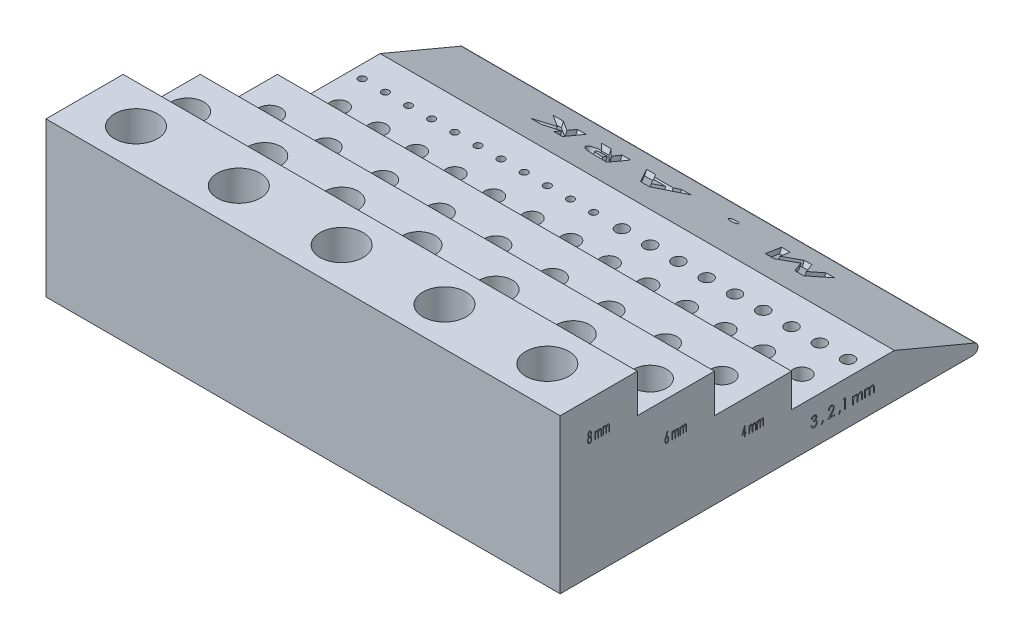
from build123d import *

# Parameters (mm, degrees)
BOSS_EXTRUDE1_DEPTH = 100
CUT_EXTRUDE1_DEPTH  = 1
SKETCH3_R           = 4.2
CUT_EXTRUDE2_DEPTH  = 20
SKETCH4_R           = 3.2
CUT_EXTRUDE3_DEPTH  = 17
SKETCH5_R           = 2.2
CUT_EXTRUDE4_DEPTH  = 10
SKETCH6_R           = 1.2
SKETCH6_R_2         = 1.7
SKETCH6_R_3         = 0.7
CUT_EXTRUDE5_DEPTH  = 5
CUT_EXTRUDE6_DEPTH  = 1


with BuildPart() as part:
    # Sketch1 → Boss-Extrude1 (new body)
    with BuildSketch(Plane(origin=(0, 0, 0), x_dir=(0, 0, -1), z_dir=(1, 0, 0))):
        with BuildLine():
            Line((-26.570827536, 30), (-41.570827536, 30))
            Line((-41.570827536, 30), (-41.570827536, 0))
            Line((-41.570827536, 0), (38.696623968, 0))
            ThreePointArc((38.696623968, 0), (39.676909119, 0.802411986), (39.084009161, 1.921917953))
            Line((39.084009161, 1.921917953), (23.429172464, 8.5))
            Line((23.429172464, 8.5), (3.429172464, 8.5))
            Line((3.429172464, 8.5), (3.429172464, 15))
            Line((3.429172464, 15), (-11.570827536, 15))
            Line((-11.570827536, 15), (-11.570827536, 22.5))
            Line((-11.570827536, 22.5), (-26.570827536, 22.5))
            Line((-26.570827536, 22.5), (-26.570827536, 30))
        make_face()
    extrude(amount=BOSS_EXTRUDE1_DEPTH)

    # Sketch2 → Cut-Extrude1 (cut)
    # profile 1 of 5: a face of its own
    with BuildSketch(Plane(origin=(0, 15.591860953, -6.551619962), x_dir=(1, 0, 0), z_dir=(0, 0.9219179530895335, -0.3873851930200802))):
        Polygon((75.872395833, 25.319447397), (74.156650641, 25.319447397), (72.147435897, 28.807027525), (70.130208333, 25.319447397), (68.421474359, 25.319447397), (66.987179487, 30.319447397), (68.676883013, 30.319447397), (69.583333333, 27.161394512), (71.409254808, 30.319447397), (72.892628205, 30.319447397), (74.711538462, 27.161394512), (75.617988782, 30.319447397), (77.307692308, 30.319447397), align=None)
    # profile 2 of 5: a face of its own
    with BuildSketch(Plane(origin=(0, 15.591860953, -6.551619962), x_dir=(1, 0, 0), z_dir=(0, 0.9219179530895335, -0.3873851930200802))):
        with BuildLine():
            add(Edge.make_bspline(
                [(58.108974359, 29.293806371), (58.047071708, 29.29556492), (57.927161736, 29.298971359), (57.754550795, 29.329877499), (57.595518219, 29.378463157), (57.47467336, 29.436250827), (57.38918168, 29.491088724), (57.332963346, 29.533298898), (57.285678678, 29.578192812), (57.247226741, 29.625826384), (57.216426058, 29.674990935), (57.195281461, 29.72720493), (57.181573286, 29.781212277), (57.180180881, 29.818231715), (57.179487179, 29.836674961)],
                knots=[0, 0, 0, 0, 1.890282304, 3.661615347, 5.339665862, 6.95963902, 7.735122552, 8.441186138, 9.105077201, 9.721737845, 10.307935609, 10.870666817, 11.437361294, 12, 12, 12, 12], degree=3))
            add(Edge.make_bspline(
                [(57.179487179, 29.836674961), (57.180184427, 29.855116113), (57.181583948, 29.892131352), (57.195238578, 29.9461703), (57.216696964, 29.998528123), (57.246896377, 30.048386162), (57.285685524, 30.096182828), (57.333266684, 30.140982535), (57.38881562, 30.184412515), (57.474966847, 30.238931124), (57.595371489, 30.29794559), (57.754398884, 30.3477016), (57.927176264, 30.378318712), (58.047076654, 30.381768851), (58.108974359, 30.383549961)],
                knots=[0, 0, 0, 0, 0.561586126, 1.127220436, 1.688898891, 2.282709044, 2.898216044, 3.560865105, 4.271834527, 5.045867291, 6.667261345, 8.345234772, 10.11325402, 12, 12, 12, 12], degree=3))
            add(Edge.make_bspline(
                [(58.108974359, 30.383549961), (58.170872064, 30.381768851), (58.290772454, 30.378318712), (58.463549834, 30.3477016), (58.622577229, 30.29794559), (58.742981871, 30.238931124), (58.829133098, 30.184412515), (58.884682034, 30.140982535), (58.932263194, 30.096182828), (58.971052341, 30.048386162), (59.001251754, 29.998528123), (59.02271014, 29.9461703), (59.03636477, 29.892131352), (59.037764291, 29.855116113), (59.038461538, 29.836674961)],
                knots=[0, 0, 0, 0, 1.88674598, 3.654765228, 5.332738655, 6.954132709, 7.728165473, 8.439134895, 9.101783956, 9.717290956, 10.311101109, 10.872779564, 11.438413874, 12, 12, 12, 12], degree=3))
            add(Edge.make_bspline(
                [(59.038461538, 29.836674961), (59.037767837, 29.818231715), (59.036375432, 29.781212277), (59.022667257, 29.72720493), (59.00152266, 29.674990935), (58.970721977, 29.625826384), (58.93227004, 29.578192812), (58.884985372, 29.533298898), (58.828767038, 29.491088724), (58.743275358, 29.436250827), (58.622430498, 29.378463157), (58.463397923, 29.329877499), (58.290786982, 29.298971359), (58.17087701, 29.29556492), (58.108974359, 29.293806371)],
                knots=[0, 0, 0, 0, 0.562638706, 1.129333183, 1.692064391, 2.278262155, 2.894922799, 3.558813862, 4.264877448, 5.04036098, 6.660334138, 8.338384653, 10.109717696, 12, 12, 12, 12], degree=3))
        make_face()
    # profile 3 of 5: a face of its own
    with BuildSketch(Plane(origin=(0, 15.591860953, -6.551619962), x_dir=(1, 0, 0), z_dir=(0, 0.9219179530895335, -0.3873851930200802))):
        Polygon((45.897435897, 25.319447397), (44.163661859, 25.319447397), (40.737179487, 30.319447397), (42.525040064, 30.319447397), (43.217147436, 29.293806371), (46.848958333, 29.293806371), (47.541065705, 30.319447397), (49.326923077, 30.319447397), align=None)
        Polygon((45.032051282, 26.66059323), (46.241987179, 28.396370474), (43.823116987, 28.396370474), align=None, mode=Mode.SUBTRACT)
    # profile 4 of 5: a face of its own
    with BuildSketch(Plane(origin=(0, 15.591860953, -6.551619962), x_dir=(1, 0, 0), z_dir=(0, 0.9219179530895335, -0.3873851930200802))):
        with BuildLine():
            Line((37.628205128, 25.319447397), (35.842347756, 25.319447397))
            add(Edge.make_bspline(
                [(35.842347756, 25.319447397), (35.724487587, 25.319693994), (35.497424907, 25.320169075), (35.170211271, 25.327613035), (34.869303072, 25.337869513), (34.594837636, 25.35415248), (34.346577952, 25.373275015), (34.12482753, 25.398479617), (33.929141978, 25.426550094), (33.757007843, 25.460959618), (33.602032652, 25.501036108), (33.457667636, 25.5462309), (33.320246972, 25.596252455), (33.192005097, 25.656010778), (33.069168546, 25.716459773), (32.955703644, 25.786641173), (32.849161522, 25.861716312), (32.750381802, 25.942296108), (32.660939376, 26.027572363), (32.584864644, 26.118673201), (32.518289253, 26.211999095), (32.46584932, 26.310747509), (32.422426111, 26.412195746), (32.394289529, 26.518208631), (32.374958946, 26.627503189), (32.372861088, 26.701905546), (32.371794872, 26.739719833)],
                knots=[0, 0, 0, 0, 2.054625737, 3.958324752, 5.705610961, 7.303110704, 8.751250219, 10.045757343, 11.193213158, 12.196565642, 13.104283104, 13.982388645, 14.833239245, 15.651162596, 16.447682712, 17.218305782, 17.974081113, 18.718588896, 19.438929515, 20.124549066, 20.784950185, 21.433419493, 22.070079251, 22.704099634, 23.341371015, 24, 24, 24, 24], degree=3))
            add(Edge.make_bspline(
                [(32.371794872, 26.739719833), (32.373163321, 26.779206395), (32.375860267, 26.857026672), (32.396622332, 26.971009903), (32.429586275, 27.080563853), (32.477228114, 27.184426937), (32.53651255, 27.284500293), (32.612136855, 27.376983996), (32.697991974, 27.467259371), (32.79981667, 27.550126402), (32.913670632, 27.629409894), (33.042051399, 27.702009119), (33.182595393, 27.771447884), (33.337097504, 27.835553394), (33.505823539, 27.892750412), (33.687121896, 27.946988285), (33.881926294, 27.996248478), (34.016969837, 28.023670242), (34.086538462, 28.037796756)],
                knots=[0, 0, 0, 0, 0.810222936, 1.596790625, 2.370835043, 3.153090443, 3.937145512, 4.75176338, 5.600057701, 6.49081968, 7.441486586, 8.445534236, 9.51534573, 10.658423592, 11.876629687, 13.171284135, 14.542767257, 16, 16, 16, 16], degree=3))
            Line((34.086538462, 28.037796756), (31.955128205, 30.319447397))
            Line((31.955128205, 30.319447397), (33.839142628, 30.319447397))
            Line((33.839142628, 30.319447397), (35.874399038, 28.139960217))
            Line((35.874399038, 28.139960217), (35.961538462, 28.139960217))
            Line((35.961538462, 28.139960217), (35.961538462, 30.319447397))
            Line((35.961538462, 30.319447397), (37.628205128, 30.319447397))
            Line((37.628205128, 30.319447397), (37.628205128, 25.319447397))
        make_face()
        with BuildLine():
            Line((35.961538462, 27.24252432), (35.437700321, 27.24252432))
            add(Edge.make_bspline(
                [(35.437700321, 27.24252432), (35.373930756, 27.242038389), (35.251379222, 27.241104534), (35.074987498, 27.23686076), (34.914035689, 27.226521604), (34.768751501, 27.213624973), (34.638846363, 27.198564076), (34.524968133, 27.17728734), (34.425977823, 27.153951251), (34.34173092, 27.125967007), (34.269819248, 27.093443043), (34.20813899, 27.056317414), (34.155281676, 27.014398092), (34.112603866, 26.966450756), (34.078711626, 26.913962947), (34.055978507, 26.855990993), (34.04120176, 26.793537946), (34.03939628, 26.750158971), (34.038461538, 26.727700602)],
                knots=[0, 0, 0, 0, 1.864217988, 3.58263028, 5.156981084, 6.577823731, 7.846481026, 8.977814605, 9.962536077, 10.817449465, 11.568634701, 12.264937932, 12.917311116, 13.532486291, 14.13356444, 14.733452884, 15.344277182, 16, 16, 16, 16], degree=3))
            add(Edge.make_bspline(
                [(34.038461538, 26.727700602), (34.040012903, 26.701033517), (34.043089772, 26.648143847), (34.073956076, 26.572690985), (34.120646344, 26.50226864), (34.187266483, 26.439561479), (34.268561062, 26.384373982), (34.362547745, 26.33569595), (34.469874654, 26.297495286), (34.56873503, 26.271079985), (34.659587204, 26.255920231), (34.74171553, 26.244818237), (34.836958503, 26.236061856), (34.945203103, 26.229487555), (35.066052581, 26.223251725), (35.199963686, 26.219391254), (35.346883789, 26.217681119), (35.449385347, 26.217156633), (35.502804487, 26.216883294)],
                knots=[0, 0, 0, 0, 0.753729741, 1.494895939, 2.281014262, 3.139111267, 4.072595753, 5.064694612, 6.135381994, 7.301098708, 7.965006724, 8.749293934, 9.653884866, 10.679826083, 11.82826276, 13.089614969, 14.483239984, 16, 16, 16, 16], degree=3))
            Line((35.502804487, 26.216883294), (35.961538462, 26.216883294))
            Line((35.961538462, 26.216883294), (35.961538462, 27.24252432))
        make_face(mode=Mode.SUBTRACT)
    # profile 5 of 5: a face of its own
    with BuildSketch(Plane(origin=(0, 15.591860953, -6.551619962), x_dir=(1, 0, 0), z_dir=(0, 0.9219179530895335, -0.3873851930200802))):
        Polygon((28.974358974, 25.319447397), (27.307692308, 25.319447397), (27.307692308, 26.978101243), (24.966947115, 25.319447397), (22.835536859, 25.319447397), (25.958533654, 27.530985858), (22.532051282, 30.319447397), (24.559294872, 30.319447397), (27.307692308, 28.081867268), (27.307692308, 30.319447397), (28.974358974, 30.319447397), align=None)
    extrude(amount=-CUT_EXTRUDE1_DEPTH, mode=Mode.SUBTRACT)

    # Sketch3 → Cut-Extrude2 (cut)
    with BuildSketch(Plane(origin=(0, 30, 0), x_dir=(1, 0, 0), z_dir=(0, 1, 0))):
        with Locations(Location((50, -34.070827536, 0), (0, 0, 270))):
            Circle(SKETCH3_R)
        with Locations(Location((70, -34.070827536, 0), (0, 0, 270))):
            Circle(SKETCH3_R)
        with Locations(Location((90, -34.070827536, 0), (0, 0, 270))):
            Circle(SKETCH3_R)
        with Locations(Location((30, -34.070827536, 0), (0, 0, 270))):
            Circle(SKETCH3_R)
        with Locations(Location((10, -34.070827536, 0), (0, 0, 270))):
            Circle(SKETCH3_R)
    extrude(amount=-CUT_EXTRUDE2_DEPTH, mode=Mode.SUBTRACT)

    # Sketch4 → Cut-Extrude3 (cut)
    with BuildSketch(Plane(origin=(0, 22.5, 0), x_dir=(1, 0, 0), z_dir=(0, 1, 0))):
        with Locations(Location((50, -19.070827536, 0), (0, 0, 270))):
            Circle(SKETCH4_R)
        with Locations(Location((65, -19.070827536, 0), (0, 0, 270))):
            Circle(SKETCH4_R)
        with Locations(Location((80, -19.070827536, 0), (0, 0, 270))):
            Circle(SKETCH4_R)
        with Locations(Location((95, -19.070827536, 0), (0, 0, 270))):
            Circle(SKETCH4_R)
        with Locations(Location((5, -19.070827536, 0), (0, 0, 90))):
            Circle(SKETCH4_R)
        with Locations(Location((20, -19.070827536, 0), (0, 0, 90))):
            Circle(SKETCH4_R)
        with Locations(Location((35, -19.070827536, 0), (0, 0, 90))):
            Circle(SKETCH4_R)
    extrude(amount=-CUT_EXTRUDE3_DEPTH, mode=Mode.SUBTRACT)

    # Sketch5 → Cut-Extrude4 (cut)
    with BuildSketch(Plane(origin=(0, 15, 0), x_dir=(1, 0, 0), z_dir=(0, 1, 0))):
        with Locations(Location((50, -4.070827536, 0), (0, 0, 270))):
            Circle(SKETCH5_R)
        with Locations(Location((61, -4.070827536, 0), (0, 0, 270))):
            Circle(SKETCH5_R)
        with Locations(Location((72, -4.070827536, 0), (0, 0, 270))):
            Circle(SKETCH5_R)
        with Locations(Location((83, -4.070827536, 0), (0, 0, 270))):
            Circle(SKETCH5_R)
        with Locations(Location((94, -4.070827536, 0), (0, 0, 270))):
            Circle(SKETCH5_R)
        with Locations(Location((6, -4.070827536, 0), (0, 0, 90))):
            Circle(SKETCH5_R)
        with Locations(Location((17, -4.070827536, 0), (0, 0, 90))):
            Circle(SKETCH5_R)
        with Locations(Location((28, -4.070827536, 0), (0, 0, 90))):
            Circle(SKETCH5_R)
        with Locations(Location((39, -4.070827536, 0), (0, 0, 90))):
            Circle(SKETCH5_R)
    extrude(amount=-CUT_EXTRUDE4_DEPTH, mode=Mode.SUBTRACT)

    # Sketch6 → Cut-Extrude5 (cut)
    with BuildSketch(Plane(origin=(0, 8.5, 0), x_dir=(1, 0, 0), z_dir=(0, 1, 0))):
        with Locations(Location((75, 17.429172464, 0), (0, 0, 270))):
            Circle(SKETCH6_R)
        with Locations(Location((50, 10.429172464, 0), (0, 0, 270))):
            Circle(SKETCH6_R_2)
        with Locations(Location((57.5, 10.429172464, 0), (0, 0, 270))):
            Circle(SKETCH6_R_2)
        with Locations(Location((65, 10.429172464, 0), (0, 0, 270))):
            Circle(SKETCH6_R_2)
        with Locations(Location((72.5, 10.429172464, 0), (0, 0, 270))):
            Circle(SKETCH6_R_2)
        with Locations(Location((80, 10.429172464, 0), (0, 0, 270))):
            Circle(SKETCH6_R_2)
        with Locations(Location((87.5, 10.429172464, 0), (0, 0, 270))):
            Circle(SKETCH6_R_2)
        with Locations(Location((95, 10.429172464, 0), (0, 0, 270))):
            Circle(SKETCH6_R_2)
        with Locations(Location((5, 10.429172464, 0), (0, 0, 90))):
            Circle(SKETCH6_R_2)
        with Locations(Location((12.5, 10.429172464, 0), (0, 0, 90))):
            Circle(SKETCH6_R_2)
        with Locations(Location((20, 10.429172464, 0), (0, 0, 90))):
            Circle(SKETCH6_R_2)
        with Locations(Location((27.5, 10.429172464, 0), (0, 0, 90))):
            Circle(SKETCH6_R_2)
        with Locations(Location((35, 10.429172464, 0), (0, 0, 90))):
            Circle(SKETCH6_R_2)
        with Locations(Location((42.5, 10.429172464, 0), (0, 0, 90))):
            Circle(SKETCH6_R_2)
        with Locations(Location((80.5, 17.429172464, 0), (0, 0, 270))):
            Circle(SKETCH6_R)
        with Locations(Location((86, 17.429172464, 0), (0, 0, 270))):
            Circle(SKETCH6_R)
        with Locations(Location((91.5, 17.429172464, 0), (0, 0, 270))):
            Circle(SKETCH6_R)
        with Locations(Location((58.5, 17.429172464, 0), (0, 0, 90))):
            Circle(SKETCH6_R)
        with Locations(Location((64, 17.429172464, 0), (0, 0, 90))):
            Circle(SKETCH6_R)
        with Locations(Location((69.5, 17.429172464, 0), (0, 0, 90))):
            Circle(SKETCH6_R)
        with Locations(Location((97, 17.429172464, 0), (0, 0, 270))):
            Circle(SKETCH6_R)
        with Locations(Location((53, 17.429172464, 0), (0, 0, 90))):
            Circle(SKETCH6_R)
        with Locations(Location((25, 17.429172464, 0), (0, 0, 270))):
            Circle(SKETCH6_R_3)
        with Locations(Location((29.5, 17.429172464, 0), (0, 0, 270))):
            Circle(SKETCH6_R_3)
        with Locations(Location((34, 17.429172464, 0), (0, 0, 270))):
            Circle(SKETCH6_R_3)
        with Locations(Location((38.5, 17.429172464, 0), (0, 0, 270))):
            Circle(SKETCH6_R_3)
        with Locations(Location((43, 17.429172464, 0), (0, 0, 270))):
            Circle(SKETCH6_R_3)
        with Locations(Location((47.5, 17.429172464, 0), (0, 0, 270))):
            Circle(SKETCH6_R_3)
        with Locations(Location((2.5, 17.429172464, 0), (0, 0, 90))):
            Circle(SKETCH6_R_3)
        with Locations(Location((7, 17.429172464, 0), (0, 0, 90))):
            Circle(SKETCH6_R_3)
        with Locations(Location((11.5, 17.429172464, 0), (0, 0, 90))):
            Circle(SKETCH6_R_3)
        with Locations(Location((16, 17.429172464, 0), (0, 0, 90))):
            Circle(SKETCH6_R_3)
        with Locations(Location((20.5, 17.429172464, 0), (0, 0, 90))):
            Circle(SKETCH6_R_3)
    extrude(amount=-CUT_EXTRUDE5_DEPTH, mode=Mode.SUBTRACT)

    # Sketch7 → Cut-Extrude6 (cut)
    # profile 1 of 16: a face of its own
    with BuildSketch(Plane(origin=(100, 0, 0), x_dir=(0, 0, -1), z_dir=(1, 0, 0))):
        with BuildLine():
            add(Edge.make_bspline(
                [(-35.66217369, 23.614182692), (-35.643311727, 23.596982143), (-35.606352763, 23.563278626), (-35.559129458, 23.506232227), (-35.520747388, 23.445482376), (-35.49129716, 23.380744631), (-35.469270321, 23.312376812), (-35.453691344, 23.239769005), (-35.444462831, 23.162631808), (-35.443245892, 23.109667622), (-35.442622408, 23.082532051)],
                knots=[0, 0, 0, 0, 1.028098533, 2.014501652, 2.974940671, 3.91685289, 4.873663719, 5.865210227, 6.906265818, 8, 8, 8, 8], degree=3))
            add(Edge.make_bspline(
                [(-35.442622408, 23.082532051), (-35.442770331, 23.063290465), (-35.44306248, 23.025288198), (-35.447877556, 22.969163435), (-35.454390598, 22.914689667), (-35.464177722, 22.861880344), (-35.476341987, 22.810834941), (-35.491874565, 22.761555185), (-35.509555318, 22.71388918), (-35.523997846, 22.68339842), (-35.531164075, 22.668269231)],
                knots=[0, 0, 0, 0, 1.08019374, 2.13339023, 3.161289449, 4.160104365, 5.147820364, 6.106142307, 7.060288022, 8, 8, 8, 8], degree=3))
            add(Edge.make_bspline(
                [(-35.531164075, 22.668269231), (-35.540268786, 22.650953969), (-35.55789883, 22.617425302), (-35.589602725, 22.572432556), (-35.624277307, 22.534260297), (-35.661873472, 22.502809344), (-35.702759573, 22.478556555), (-35.746495276, 22.461029614), (-35.793258678, 22.450897635), (-35.825319959, 22.449453826), (-35.84166087, 22.448717949)],
                knots=[0, 0, 0, 0, 1.164790379, 2.255459354, 3.269308587, 4.230115972, 5.16496749, 6.090013316, 7.026522944, 8, 8, 8, 8], degree=3))
            add(Edge.make_bspline(
                [(-35.84166087, 22.448717949), (-35.857457171, 22.449372919), (-35.888236063, 22.450649119), (-35.933043166, 22.459485107), (-35.974601605, 22.475035339), (-36.013704373, 22.49597483), (-36.049559687, 22.523554582), (-36.082034926, 22.557326317), (-36.112136587, 22.59648894), (-36.137745755, 22.641721465), (-36.161055922, 22.690009837), (-36.181533724, 22.740190456), (-36.19883872, 22.79156678), (-36.212696697, 22.844219846), (-36.224238876, 22.897897506), (-36.231479112, 22.952976086), (-36.236632611, 23.009117187), (-36.237205294, 23.046996362), (-36.237494203, 23.066105769)],
                knots=[0, 0, 0, 0, 0.93210163, 1.816188234, 2.681421152, 3.541867079, 4.424582652, 5.338583498, 6.300106935, 7.331444284, 8.399468063, 9.463442364, 10.527620965, 11.5962552, 12.675128012, 13.765169281, 14.872565475, 16, 16, 16, 16], degree=3))
            add(Edge.make_bspline(
                [(-36.237494203, 23.066105769), (-36.236919464, 23.093780975), (-36.235796871, 23.147836751), (-36.225859978, 23.226631008), (-36.210411508, 23.301252456), (-36.188434764, 23.371929741), (-36.158825064, 23.439212438), (-36.118747725, 23.501653011), (-36.071147084, 23.561630919), (-36.032766795, 23.596398851), (-36.013135229, 23.614182692)],
                knots=[0, 0, 0, 0, 1.083620479, 2.116549601, 3.105550056, 4.065117048, 5.011056378, 5.974749335, 6.964081743, 8, 8, 8, 8], degree=3))
            add(Edge.make_bspline(
                [(-36.013135229, 23.614182692), (-36.026988254, 23.627058334), (-36.054716105, 23.652829879), (-36.089755847, 23.697747354), (-36.119828979, 23.746760849), (-36.144063668, 23.799984154), (-36.162661773, 23.856500911), (-36.176421547, 23.915194179), (-36.184535567, 23.976001652), (-36.185648673, 24.017203597), (-36.186212152, 24.038060897)],
                knots=[0, 0, 0, 0, 0.96026516, 1.922041397, 2.885063086, 3.878551471, 4.887693557, 5.905523736, 6.939731545, 8, 8, 8, 8], degree=3))
            add(Edge.make_bspline(
                [(-36.186212152, 24.038060897), (-36.185716734, 24.059328067), (-36.184727828, 24.101779543), (-36.17534118, 24.16502784), (-36.161176946, 24.227601423), (-36.140749412, 24.288457712), (-36.115707807, 24.345755726), (-36.086059126, 24.397835698), (-36.051345012, 24.442933289), (-36.013024815, 24.481540146), (-35.971584641, 24.512864303), (-35.92728744, 24.534524556), (-35.881535752, 24.548842952), (-35.850178513, 24.550467272), (-35.834449331, 24.551282051)],
                knots=[0, 0, 0, 0, 1.118370103, 2.232382745, 3.357400046, 4.490682408, 5.604429071, 6.643375208, 7.635646737, 8.5896595, 9.49896649, 10.353747354, 11.174219177, 12, 12, 12, 12], degree=3))
            add(Edge.make_bspline(
                [(-35.834449331, 24.551282051), (-35.819129627, 24.550444541), (-35.788576303, 24.548774226), (-35.743835743, 24.534772275), (-35.701443768, 24.511708249), (-35.661026205, 24.480760082), (-35.623789734, 24.44203225), (-35.59062213, 24.396499197), (-35.561587299, 24.344720389), (-35.537764179, 24.287421902), (-35.518094552, 24.226481961), (-35.504249655, 24.163149814), (-35.495470908, 24.098269857), (-35.49442956, 24.05451524), (-35.493904459, 24.032451923)],
                knots=[0, 0, 0, 0, 0.807715716, 1.610892714, 2.450136696, 3.345828206, 4.28846152, 5.27726717, 6.312996349, 7.415913438, 8.548927439, 9.690229842, 10.835295664, 12, 12, 12, 12], degree=3))
            add(Edge.make_bspline(
                [(-35.493904459, 24.032451923), (-35.494491572, 24.010797234), (-35.495636917, 23.968553014), (-35.503141094, 23.906915826), (-35.516403824, 23.848944516), (-35.534851237, 23.794533485), (-35.558440355, 23.743744285), (-35.587852137, 23.696731039), (-35.62197935, 23.652899756), (-35.648760806, 23.627102608), (-35.66217369, 23.614182692)],
                knots=[0, 0, 0, 0, 1.11781901, 2.18065441, 3.199078226, 4.182268492, 5.141382967, 6.082566618, 7.039697092, 8, 8, 8, 8], degree=3))
        make_face()
        with BuildLine():
            add(Edge.make_bspline(
                [(-35.840458947, 24.346153846), (-35.849018074, 24.345785083), (-35.865827915, 24.345060844), (-35.890662251, 24.341130087), (-35.914287985, 24.333778215), (-35.937052807, 24.323819808), (-35.958156434, 24.310307569), (-35.978601272, 24.29467348), (-35.997311462, 24.275485742), (-36.021210605, 24.246991727), (-36.046171141, 24.206585779), (-36.068125084, 24.153469432), (-36.081189228, 24.095709142), (-36.082814248, 24.0557563), (-36.083648049, 24.03525641)],
                knots=[0, 0, 0, 0, 0.703563814, 1.3817758, 2.058566329, 2.731432367, 3.416443861, 4.112179064, 4.841451497, 5.612682303, 7.165295253, 8.719922773, 10.316985315, 12, 12, 12, 12], degree=3))
            add(Edge.make_bspline(
                [(-36.083648049, 24.03525641), (-36.082681614, 24.014749754), (-36.080771182, 23.974212561), (-36.066752648, 23.914847677), (-36.043258912, 23.858598498), (-36.01614027, 23.815334331), (-35.991466919, 23.783319867), (-35.971529749, 23.762554971), (-35.950774711, 23.745070095), (-35.929556531, 23.730460552), (-35.907341065, 23.719109377), (-35.884303881, 23.711043933), (-35.860440095, 23.70602816), (-35.844222418, 23.705429707), (-35.836051895, 23.705128205)],
                knots=[0, 0, 0, 0, 1.628891255, 3.219963276, 4.818557972, 6.453282678, 7.262228924, 8.027891852, 8.735917485, 9.415943546, 10.070993563, 10.712138042, 11.351170594, 12, 12, 12, 12], degree=3))
            add(Edge.make_bspline(
                [(-35.836051895, 23.705128205), (-35.825572499, 23.705638403), (-35.804505762, 23.706664054), (-35.773701119, 23.716029818), (-35.74397409, 23.730891958), (-35.715252026, 23.750873211), (-35.688496309, 23.776090909), (-35.66485436, 23.80603828), (-35.64418454, 23.840050801), (-35.627493607, 23.877934567), (-35.613511295, 23.917536051), (-35.604009884, 23.958134868), (-35.597613067, 23.998594616), (-35.59684883, 24.025750585), (-35.596468562, 24.039262821)],
                knots=[0, 0, 0, 0, 0.832673888, 1.673924958, 2.53935388, 3.471388708, 4.449238851, 5.455520958, 6.500384508, 7.609133218, 8.745675437, 9.839126081, 10.924794797, 12, 12, 12, 12], degree=3))
            add(Edge.make_bspline(
                [(-35.596468562, 24.039262821), (-35.597255138, 24.058017164), (-35.598810051, 24.095090983), (-35.610746626, 24.14946675), (-35.63082812, 24.20124198), (-35.653096471, 24.242072424), (-35.674732097, 24.2721984), (-35.693307348, 24.291844377), (-35.713333895, 24.308852856), (-35.73525502, 24.322763386), (-35.75913487, 24.333038863), (-35.784620715, 24.340858342), (-35.812002167, 24.345162261), (-35.830829713, 24.345818313), (-35.840458947, 24.346153846)],
                knots=[0, 0, 0, 0, 1.542296609, 3.048831039, 4.554884507, 6.099254386, 6.861900592, 7.600416468, 8.317951962, 9.019146743, 9.727622189, 10.450689518, 11.207614604, 12, 12, 12, 12], degree=3))
        make_face(mode=Mode.SUBTRACT)
        with BuildLine():
            add(Edge.make_bspline(
                [(-35.833648049, 23.5), (-35.844105295, 23.499673474), (-35.864822788, 23.499026574), (-35.895024526, 23.492065974), (-35.924230673, 23.482361773), (-35.951849713, 23.467399975), (-35.978265276, 23.448609022), (-36.003216289, 23.425404052), (-36.026910355, 23.398380942), (-36.049020884, 23.367719291), (-36.069320873, 23.334586397), (-36.086398616, 23.299208994), (-36.101936965, 23.263055669), (-36.113699648, 23.224965582), (-36.123648586, 23.185856124), (-36.129556823, 23.145018156), (-36.134520383, 23.103084418), (-36.13479248, 23.074535478), (-36.1349301, 23.060096154)],
                knots=[0, 0, 0, 0, 0.852397528, 1.68873722, 2.51994157, 3.359049784, 4.242687987, 5.161173052, 6.134785863, 7.173129302, 8.244841651, 9.30320907, 10.378688043, 11.454775085, 12.55512549, 13.670345808, 14.821720392, 16, 16, 16, 16], degree=3))
            add(Edge.make_bspline(
                [(-36.1349301, 23.060096154), (-36.134451457, 23.042179313), (-36.133508512, 23.006882456), (-36.1264923, 22.954559518), (-36.11491628, 22.903881396), (-36.099032041, 22.8551105), (-36.079122251, 22.809900964), (-36.054724982, 22.769522525), (-36.026862919, 22.73456679), (-35.995301397, 22.705341083), (-35.960705524, 22.682022842), (-35.922794504, 22.666162959), (-35.882581161, 22.655420496), (-35.854686784, 22.654377928), (-35.840458947, 22.653846154)],
                knots=[0, 0, 0, 0, 1.154508561, 2.274425763, 3.395665181, 4.50073251, 5.575657037, 6.572039419, 7.533149758, 8.446801855, 9.334837236, 10.206198366, 11.085051482, 12, 12, 12, 12], degree=3))
            add(Edge.make_bspline(
                [(-35.840458947, 22.653846154), (-35.829478387, 22.654213578), (-35.807881237, 22.654936248), (-35.776355369, 22.66117831), (-35.746483179, 22.671086714), (-35.718637132, 22.685469724), (-35.692133616, 22.703178352), (-35.667874782, 22.725417853), (-35.645058114, 22.751415111), (-35.617704835, 22.791714318), (-35.588054677, 22.84713206), (-35.563466179, 22.919851504), (-35.547496935, 22.997567942), (-35.545970101, 23.051333247), (-35.545186511, 23.078926282)],
                knots=[0, 0, 0, 0, 0.68776425, 1.352731333, 2.006644972, 2.654366363, 3.311487577, 3.999098951, 4.711048292, 5.475088677, 7.048010856, 8.6339129, 10.27248148, 12, 12, 12, 12], degree=3))
            add(Edge.make_bspline(
                [(-35.545186511, 23.078926282), (-35.54610708, 23.105721783), (-35.547914983, 23.158345416), (-35.564555747, 23.234750392), (-35.5910539, 23.306510578), (-35.621884161, 23.361523557), (-35.650377757, 23.401599431), (-35.673291579, 23.427669857), (-35.697013264, 23.450226616), (-35.722345782, 23.468206602), (-35.748547625, 23.482460404), (-35.77588249, 23.492701032), (-35.804393802, 23.498845144), (-35.823869736, 23.499613986), (-35.833648049, 23.5)],
                knots=[0, 0, 0, 0, 1.718573954, 3.375104129, 4.994919686, 6.614826025, 7.407285526, 8.148594507, 8.840233938, 9.504100944, 10.137126096, 10.750327411, 11.372574885, 12, 12, 12, 12], degree=3))
        make_face(mode=Mode.SUBTRACT)
    # profile 2 of 16: a face of its own
    with BuildSketch(Plane(origin=(100, 0, 0), x_dir=(0, 0, -1), z_dir=(1, 0, 0))):
        with BuildLine():
            Line((-34.801596767, 23.961538462), (-34.699032665, 23.961538462))
            Line((-34.699032665, 23.961538462), (-34.699032665, 23.707532051))
            add(Edge.make_bspline(
                [(-34.699032665, 23.707532051), (-34.689585037, 23.729574842), (-34.671803373, 23.771062243), (-34.642206801, 23.827463676), (-34.612117474, 23.874534553), (-34.589662555, 23.900848381), (-34.579240998, 23.913060897)],
                knots=[0, 0, 0, 0, 1.203472509, 2.265091899, 3.194811391, 4, 4, 4, 4], degree=3))
            add(Edge.make_bspline(
                [(-34.579240998, 23.913060897), (-34.56530018, 23.924385067), (-34.538441451, 23.946202495), (-34.493782876, 23.969697223), (-34.447921335, 23.984203183), (-34.416814635, 23.986191438), (-34.401356382, 23.987179487)],
                knots=[0, 0, 0, 0, 1.092784587, 2.105386224, 3.058485168, 4, 4, 4, 4], degree=3))
            add(Edge.make_bspline(
                [(-34.401356382, 23.987179487), (-34.390894674, 23.986587296), (-34.370097393, 23.985410052), (-34.339288153, 23.977443717), (-34.309553527, 23.964096821), (-34.281123521, 23.945303713), (-34.254202597, 23.922753405), (-34.229467308, 23.896477549), (-34.207781118, 23.866457846), (-34.188287939, 23.832458451), (-34.170209054, 23.793169174), (-34.154799751, 23.746775499), (-34.139178795, 23.693318278), (-34.131171002, 23.654718739), (-34.12691728, 23.634214744)],
                knots=[0, 0, 0, 0, 0.777253477, 1.545135583, 2.3492976, 3.188934854, 4.069570613, 4.954279667, 5.863478623, 6.815079473, 7.863179112, 9.071614798, 10.444447851, 12, 12, 12, 12], degree=3))
            add(Edge.make_bspline(
                [(-34.12691728, 23.634214744), (-34.117677886, 23.661522129), (-34.10008373, 23.713522335), (-34.067045794, 23.784708757), (-34.031276514, 23.846012785), (-33.991627203, 23.896457505), (-33.949380995, 23.93653972), (-33.905164018, 23.965519879), (-33.858797509, 23.983947564), (-33.826994405, 23.986107581), (-33.811212152, 23.987179487)],
                knots=[0, 0, 0, 0, 1.371823988, 2.612301758, 3.730144734, 4.744134464, 5.657476872, 6.490031258, 7.250679736, 8, 8, 8, 8], degree=3))
            add(Edge.make_bspline(
                [(-33.811212152, 23.987179487), (-33.796679539, 23.986231453), (-33.767724885, 23.984342597), (-33.725724705, 23.969633429), (-33.687160964, 23.944771872), (-33.651903651, 23.910876374), (-33.619780868, 23.869141602), (-33.592879492, 23.819086534), (-33.56935025, 23.762156857), (-33.55460865, 23.709036987), (-33.54464038, 23.661745649), (-33.538019897, 23.621355538), (-33.531763263, 23.576783348), (-33.527749086, 23.527945224), (-33.5240865, 23.474925846), (-33.521260225, 23.41762722), (-33.519675782, 23.35604562), (-33.519589814, 23.313569309), (-33.519545485, 23.291666667)],
                knots=[0, 0, 0, 0, 0.842389127, 1.678368893, 2.549413255, 3.487172311, 4.50433567, 5.593870485, 6.775793953, 8.073840754, 8.786916111, 9.58090116, 10.449215997, 11.398820096, 12.424485337, 13.534376325, 14.728616702, 16, 16, 16, 16], degree=3))
            Line((-33.519545485, 23.291666667), (-33.519545485, 22.5))
            Line((-33.519545485, 22.5), (-33.622109588, 22.5))
            Line((-33.622109588, 22.5), (-33.622109588, 23.292467949))
            add(Edge.make_bspline(
                [(-33.622109588, 23.292467949), (-33.622218785, 23.311164715), (-33.622428611, 23.347090846), (-33.623116821, 23.398647924), (-33.624647722, 23.44567166), (-33.627160103, 23.487997944), (-33.629727715, 23.525835892), (-33.633481858, 23.559071146), (-33.637151768, 23.587883399), (-33.643616258, 23.619541262), (-33.653017459, 23.654559729), (-33.668656957, 23.692173427), (-33.687594953, 23.725815716), (-33.710264643, 23.754350502), (-33.735520624, 23.778296387), (-33.763927585, 23.79532051), (-33.794967909, 23.806098327), (-33.816599428, 23.807153719), (-33.827638434, 23.807692308)],
                knots=[0, 0, 0, 0, 1.465355158, 2.815703088, 4.041005542, 5.152236349, 6.138816786, 7.012633147, 7.77345887, 8.413888923, 9.543937679, 10.609112204, 11.598353984, 12.55951209, 13.45579399, 14.310213737, 15.137667608, 16, 16, 16, 16], degree=3))
            add(Edge.make_bspline(
                [(-33.827638434, 23.807692308), (-33.841285377, 23.806844725), (-33.868785478, 23.805136753), (-33.908191422, 23.788328731), (-33.945817689, 23.763029596), (-33.980042798, 23.727237929), (-34.01160753, 23.684020231), (-34.038817159, 23.633384726), (-34.06149685, 23.576242885), (-34.076525273, 23.52360554), (-34.085857123, 23.476246062), (-34.09209941, 23.434525632), (-34.097920328, 23.387265227), (-34.101376695, 23.334281864), (-34.105334522, 23.275818186), (-34.1074138, 23.211682472), (-34.109213373, 23.141970771), (-34.109263201, 23.093617988), (-34.109289075, 23.068509615)],
                knots=[0, 0, 0, 0, 0.757020144, 1.525479302, 2.351205249, 3.272232181, 4.268163411, 5.327280507, 6.466141507, 7.688885632, 8.372012501, 9.155181029, 10.039603028, 11.024881085, 12.113607178, 13.305308222, 14.600714991, 16, 16, 16, 16], degree=3))
            Line((-34.109289075, 23.068509615), (-34.109289075, 22.5))
            Line((-34.109289075, 22.5), (-34.211853177, 22.5))
            Line((-34.211853177, 22.5), (-34.211853177, 23.243189103))
            add(Edge.make_bspline(
                [(-34.211853177, 23.243189103), (-34.211969633, 23.264155761), (-34.212193652, 23.30448798), (-34.212786948, 23.362326001), (-34.214615708, 23.414934515), (-34.216166928, 23.462259311), (-34.21975205, 23.504150828), (-34.222678546, 23.540930166), (-34.226493685, 23.572381245), (-34.232900033, 23.606714279), (-34.24238637, 23.644150796), (-34.25745878, 23.684676807), (-34.276790927, 23.720273715), (-34.299581489, 23.750791564), (-34.325132342, 23.77616588), (-34.35383634, 23.794609686), (-34.385367942, 23.805613711), (-34.407148175, 23.806993319), (-34.418183306, 23.807692308)],
                knots=[0, 0, 0, 0, 1.524801591, 2.933163223, 4.206017049, 5.353051367, 6.375757986, 7.26295086, 8.036314503, 8.678256659, 9.801862692, 10.840810663, 11.814330236, 12.736962165, 13.602358648, 14.418737397, 15.198840588, 16, 16, 16, 16], degree=3))
            add(Edge.make_bspline(
                [(-34.418183306, 23.807692308), (-34.431142607, 23.8067648), (-34.457633539, 23.804868823), (-34.49599183, 23.788815841), (-34.532543761, 23.76356936), (-34.567184177, 23.72937077), (-34.598436586, 23.686701417), (-34.626203615, 23.63725779), (-34.6488042, 23.580704884), (-34.664505242, 23.528972768), (-34.674243472, 23.482776865), (-34.681178745, 23.443256119), (-34.686640505, 23.399258828), (-34.69088255, 23.350869559), (-34.694491211, 23.298108421), (-34.69731117, 23.241078316), (-34.698910085, 23.179496523), (-34.698990794, 23.137020166), (-34.699032665, 23.114983974)],
                knots=[0, 0, 0, 0, 0.762581998, 1.558842418, 2.415832376, 3.37455159, 4.416586017, 5.528230753, 6.712401706, 8.004172493, 8.713791328, 9.497785129, 10.371823606, 11.329505385, 12.364510378, 13.493017667, 14.699409599, 16, 16, 16, 16], degree=3))
            Line((-34.699032665, 23.114983974), (-34.699032665, 22.5))
            Line((-34.699032665, 22.5), (-34.801596767, 22.5))
            Line((-34.801596767, 22.5), (-34.801596767, 23.961538462))
        make_face()
    # profile 3 of 16: a face of its own
    with BuildSketch(Plane(origin=(100, 0, 0), x_dir=(0, 0, -1), z_dir=(1, 0, 0))):
        with BuildLine():
            Line((-33.263135229, 23.961538462), (-33.160571126, 23.961538462))
            Line((-33.160571126, 23.961538462), (-33.160571126, 23.707532051))
            add(Edge.make_bspline(
                [(-33.160571126, 23.707532051), (-33.151123499, 23.729574842), (-33.133341834, 23.771062243), (-33.103745262, 23.827463676), (-33.073655935, 23.874534553), (-33.051201017, 23.900848381), (-33.040779459, 23.913060897)],
                knots=[0, 0, 0, 0, 1.203472509, 2.265091899, 3.194811391, 4, 4, 4, 4], degree=3))
            add(Edge.make_bspline(
                [(-33.040779459, 23.913060897), (-33.026838642, 23.924385067), (-32.999979912, 23.946202495), (-32.955321338, 23.969697223), (-32.909459796, 23.984203183), (-32.878353097, 23.986191438), (-32.862894844, 23.987179487)],
                knots=[0, 0, 0, 0, 1.092784587, 2.105386224, 3.058485168, 4, 4, 4, 4], degree=3))
            add(Edge.make_bspline(
                [(-32.862894844, 23.987179487), (-32.852433135, 23.986587296), (-32.831635854, 23.985410052), (-32.800826614, 23.977443717), (-32.771091988, 23.964096821), (-32.742661982, 23.945303713), (-32.715741058, 23.922753405), (-32.69100577, 23.896477549), (-32.66931958, 23.866457846), (-32.649826401, 23.832458451), (-32.631747515, 23.793169174), (-32.616338212, 23.746775499), (-32.600717256, 23.693318278), (-32.592709464, 23.654718739), (-32.588455741, 23.634214744)],
                knots=[0, 0, 0, 0, 0.777253477, 1.545135583, 2.3492976, 3.188934854, 4.069570613, 4.954279667, 5.863478623, 6.815079473, 7.863179112, 9.071614798, 10.444447851, 12, 12, 12, 12], degree=3))
            add(Edge.make_bspline(
                [(-32.588455741, 23.634214744), (-32.579216347, 23.661522129), (-32.561622191, 23.713522335), (-32.528584255, 23.784708757), (-32.492814975, 23.846012785), (-32.453165664, 23.896457505), (-32.410919457, 23.93653972), (-32.366702479, 23.965519879), (-32.32033597, 23.983947564), (-32.288532867, 23.986107581), (-32.272750613, 23.987179487)],
                knots=[0, 0, 0, 0, 1.371823988, 2.612301758, 3.730144734, 4.744134464, 5.657476872, 6.490031258, 7.250679736, 8, 8, 8, 8], degree=3))
            add(Edge.make_bspline(
                [(-32.272750613, 23.987179487), (-32.258218, 23.986231453), (-32.229263347, 23.984342597), (-32.187263167, 23.969633429), (-32.148699426, 23.944771872), (-32.113442112, 23.910876374), (-32.081319329, 23.869141602), (-32.054417954, 23.819086534), (-32.030888712, 23.762156857), (-32.016147111, 23.709036987), (-32.006178842, 23.661745649), (-31.999558359, 23.621355538), (-31.993301724, 23.576783348), (-31.989287548, 23.527945224), (-31.985624961, 23.474925846), (-31.982798687, 23.41762722), (-31.981214244, 23.35604562), (-31.981128275, 23.313569309), (-31.981083947, 23.291666667)],
                knots=[0, 0, 0, 0, 0.842389127, 1.678368893, 2.549413255, 3.487172311, 4.50433567, 5.593870485, 6.775793953, 8.073840754, 8.786916111, 9.58090116, 10.449215997, 11.398820096, 12.424485337, 13.534376325, 14.728616702, 16, 16, 16, 16], degree=3))
            Line((-31.981083947, 23.291666667), (-31.981083947, 22.5))
            Line((-31.981083947, 22.5), (-32.083648049, 22.5))
            Line((-32.083648049, 22.5), (-32.083648049, 23.292467949))
            add(Edge.make_bspline(
                [(-32.083648049, 23.292467949), (-32.083757247, 23.311164715), (-32.083967072, 23.347090846), (-32.084655282, 23.398647924), (-32.086186184, 23.44567166), (-32.088698565, 23.487997944), (-32.091266177, 23.525835892), (-32.095020319, 23.559071146), (-32.098690229, 23.587883399), (-32.10515472, 23.619541262), (-32.114555921, 23.654559729), (-32.130195419, 23.692173427), (-32.149133415, 23.725815716), (-32.171803105, 23.754350502), (-32.197059086, 23.778296387), (-32.225466047, 23.79532051), (-32.256506371, 23.806098327), (-32.27813789, 23.807153719), (-32.289176895, 23.807692308)],
                knots=[0, 0, 0, 0, 1.465355158, 2.815703088, 4.041005542, 5.152236349, 6.138816786, 7.012633147, 7.77345887, 8.413888923, 9.543937679, 10.609112204, 11.598353984, 12.55951209, 13.45579399, 14.310213737, 15.137667608, 16, 16, 16, 16], degree=3))
            add(Edge.make_bspline(
                [(-32.289176895, 23.807692308), (-32.302823839, 23.806844725), (-32.330323939, 23.805136753), (-32.369729883, 23.788328731), (-32.407356151, 23.763029596), (-32.441581259, 23.727237929), (-32.473145992, 23.684020231), (-32.50035562, 23.633384726), (-32.523035311, 23.576242885), (-32.538063734, 23.52360554), (-32.547395585, 23.476246062), (-32.553637872, 23.434525632), (-32.55945879, 23.387265227), (-32.562915157, 23.334281864), (-32.566872984, 23.275818186), (-32.568952262, 23.211682472), (-32.570751835, 23.141970771), (-32.570801662, 23.093617988), (-32.570827536, 23.068509615)],
                knots=[0, 0, 0, 0, 0.757020144, 1.525479302, 2.351205249, 3.272232181, 4.268163411, 5.327280507, 6.466141507, 7.688885632, 8.372012501, 9.155181029, 10.039603028, 11.024881085, 12.113607178, 13.305308222, 14.600714991, 16, 16, 16, 16], degree=3))
            Line((-32.570827536, 23.068509615), (-32.570827536, 22.5))
            Line((-32.570827536, 22.5), (-32.673391639, 22.5))
            Line((-32.673391639, 22.5), (-32.673391639, 23.243189103))
            add(Edge.make_bspline(
                [(-32.673391639, 23.243189103), (-32.673508095, 23.264155761), (-32.673732114, 23.30448798), (-32.674325409, 23.362326001), (-32.676154169, 23.414934515), (-32.67770539, 23.462259311), (-32.681290511, 23.504150828), (-32.684217008, 23.540930166), (-32.688032146, 23.572381245), (-32.694438495, 23.606714279), (-32.703924831, 23.644150796), (-32.718997241, 23.684676807), (-32.738329388, 23.720273715), (-32.761119951, 23.750791564), (-32.786670803, 23.77616588), (-32.815374801, 23.794609686), (-32.846906403, 23.805613711), (-32.868686637, 23.806993319), (-32.879721767, 23.807692308)],
                knots=[0, 0, 0, 0, 1.524801591, 2.933163223, 4.206017049, 5.353051367, 6.375757986, 7.26295086, 8.036314503, 8.678256659, 9.801862692, 10.840810663, 11.814330236, 12.736962165, 13.602358648, 14.418737397, 15.198840588, 16, 16, 16, 16], degree=3))
            add(Edge.make_bspline(
                [(-32.879721767, 23.807692308), (-32.892681068, 23.8067648), (-32.919172, 23.804868823), (-32.957530291, 23.788815841), (-32.994082223, 23.76356936), (-33.028722639, 23.72937077), (-33.059975048, 23.686701417), (-33.087742077, 23.63725779), (-33.110342662, 23.580704884), (-33.126043703, 23.528972768), (-33.135781934, 23.482776865), (-33.142717207, 23.443256119), (-33.148178966, 23.399258828), (-33.152421012, 23.350869559), (-33.156029672, 23.298108421), (-33.158849632, 23.241078316), (-33.160448547, 23.179496523), (-33.160529255, 23.137020166), (-33.160571126, 23.114983974)],
                knots=[0, 0, 0, 0, 0.762581998, 1.558842418, 2.415832376, 3.37455159, 4.416586017, 5.528230753, 6.712401706, 8.004172493, 8.713791328, 9.497785129, 10.371823606, 11.329505385, 12.364510378, 13.493017667, 14.699409599, 16, 16, 16, 16], degree=3))
            Line((-33.160571126, 23.114983974), (-33.160571126, 22.5))
            Line((-33.160571126, 22.5), (-33.263135229, 22.5))
            Line((-33.263135229, 22.5), (-33.263135229, 23.961538462))
        make_face()
    # profile 4 of 16: a face of its own
    with BuildSketch(Plane(origin=(100, 0, 0), x_dir=(0, 0, -1), z_dir=(1, 0, 0))):
        with BuildLine():
            Line((-20.699032665, 17.051282051), (-20.619705741, 16.941105769))
            Line((-20.619705741, 16.941105769), (-20.934208947, 16.132211538))
            add(Edge.make_bspline(
                [(-20.934208947, 16.132211538), (-20.913538253, 16.138621483), (-20.873827991, 16.150935563), (-20.832317017, 16.152902893), (-20.812414075, 16.153846154)],
                knots=[0, 0, 0, 0, 1.041075633, 2, 2, 2, 2], degree=3))
            add(Edge.make_bspline(
                [(-20.812414075, 16.153846154), (-20.800615917, 16.153286227), (-20.777147466, 16.152172441), (-20.742807983, 16.14383709), (-20.709789711, 16.130460322), (-20.678431248, 16.111355629), (-20.648591515, 16.086901964), (-20.619969669, 16.057333151), (-20.592817792, 16.022347321), (-20.567542837, 15.982346117), (-20.543979798, 15.938869753), (-20.524099822, 15.892038179), (-20.506878339, 15.843054502), (-20.49221339, 15.791635205), (-20.481608082, 15.737461603), (-20.474162746, 15.680849433), (-20.469112587, 15.621885374), (-20.468549956, 15.581741542), (-20.468263434, 15.561298077)],
                knots=[0, 0, 0, 0, 0.753574016, 1.498981075, 2.245609113, 3.022982037, 3.836225949, 4.70551249, 5.64811559, 6.661610386, 7.727154025, 8.805444058, 9.90967645, 11.044725704, 12.219958806, 13.434466547, 14.693488078, 16, 16, 16, 16], degree=3))
            add(Edge.make_bspline(
                [(-20.468263434, 15.561298077), (-20.468752677, 15.533363596), (-20.469710331, 15.478684165), (-20.478635504, 15.398800153), (-20.493538958, 15.322991894), (-20.513661577, 15.251739833), (-20.538941461, 15.18587752), (-20.569996481, 15.126925576), (-20.60562965, 15.074751595), (-20.645875701, 15.030319451), (-20.689410795, 14.994225443), (-20.73544356, 14.968132735), (-20.783559042, 14.951775355), (-20.816432046, 14.949736183), (-20.832846767, 14.948717949)],
                knots=[0, 0, 0, 0, 1.285474528, 2.516209894, 3.694042775, 4.838172358, 5.920349954, 6.935002017, 7.898399706, 8.82092273, 9.685946944, 10.489602921, 11.245802189, 12, 12, 12, 12], degree=3))
            add(Edge.make_bspline(
                [(-20.832846767, 14.948717949), (-20.848589667, 14.949613852), (-20.880248076, 14.951415482), (-20.926502789, 14.967290895), (-20.970617414, 14.992782638), (-21.012765248, 15.027514411), (-21.05144604, 15.071445216), (-21.085977916, 15.123708389), (-21.115945144, 15.183922784), (-21.141151949, 15.251243643), (-21.161260909, 15.32366845), (-21.175584007, 15.399529914), (-21.184758518, 15.47773848), (-21.185723652, 15.530823506), (-21.186212152, 15.557692308)],
                knots=[0, 0, 0, 0, 0.733229248, 1.474497808, 2.256264061, 3.102396204, 4.012035938, 4.978580148, 6.018517034, 7.145117003, 8.329453282, 9.52277989, 10.746163654, 12, 12, 12, 12], degree=3))
            add(Edge.make_bspline(
                [(-21.186212152, 15.557692308), (-21.185736969, 15.57826592), (-21.184769798, 15.620140776), (-21.179656372, 15.683724077), (-21.170013544, 15.748742446), (-21.157809632, 15.816445287), (-21.139514657, 15.88797371), (-21.116622609, 15.965690849), (-21.087636331, 16.050075336), (-21.0652766, 16.108244748), (-21.053599972, 16.138621795)],
                knots=[0, 0, 0, 0, 0.823764875, 1.67666398, 2.551450908, 3.454280288, 4.429376635, 5.505273281, 6.697211662, 8, 8, 8, 8], degree=3))
            Line((-21.053599972, 16.138621795), (-20.699032665, 17.051282051))
        make_face()
        with BuildLine():
            add(Edge.make_bspline(
                [(-20.835250613, 15.948717949), (-20.844220894, 15.948282246), (-20.861779737, 15.947429381), (-20.887653506, 15.942164459), (-20.911972152, 15.932816193), (-20.935380717, 15.920162855), (-20.957357641, 15.903684317), (-20.977895592, 15.883313222), (-20.997165708, 15.859490651), (-21.02125633, 15.822774648), (-21.046697645, 15.771173778), (-21.068353579, 15.702990079), (-21.081219349, 15.62868931), (-21.082821137, 15.577108838), (-21.083648049, 15.550480769)],
                knots=[0, 0, 0, 0, 0.6237417, 1.220940939, 1.826168181, 2.428540561, 3.065409347, 3.728467568, 4.43458297, 5.191593933, 6.777596373, 8.415858181, 10.149711046, 12, 12, 12, 12], degree=3))
            add(Edge.make_bspline(
                [(-21.083648049, 15.550480769), (-21.082750903, 15.524106267), (-21.081006833, 15.472833669), (-21.066776314, 15.399025512), (-21.043514285, 15.330969573), (-21.0159945, 15.279708315), (-20.9903739, 15.242995969), (-20.969873897, 15.219332297), (-20.948750969, 15.199033799), (-20.926279839, 15.18276548), (-20.903055182, 15.169859003), (-20.878727519, 15.160334966), (-20.853224996, 15.155202941), (-20.835938665, 15.154300425), (-20.827237793, 15.153846154)],
                knots=[0, 0, 0, 0, 1.827220338, 3.552155577, 5.188845171, 6.795940545, 7.566532383, 8.288543148, 8.963112845, 9.592729682, 10.206002583, 10.800901128, 11.396447671, 12, 12, 12, 12], degree=3))
            add(Edge.make_bspline(
                [(-20.827237793, 15.153846154), (-20.818536949, 15.154300449), (-20.801250673, 15.155203013), (-20.775747735, 15.160334683), (-20.751421664, 15.169860077), (-20.728190824, 15.182761282), (-20.705744087, 15.199050402), (-20.684584011, 15.219203396), (-20.66454277, 15.243143259), (-20.638811721, 15.279656192), (-20.611492196, 15.331071397), (-20.58756582, 15.398929459), (-20.57350747, 15.472848003), (-20.571737833, 15.524111136), (-20.570827536, 15.550480769)],
                knots=[0, 0, 0, 0, 0.60370121, 1.199394659, 1.79443995, 2.40786413, 3.037636278, 3.712372374, 4.428539666, 5.199321589, 6.806813392, 8.446968197, 10.172328933, 12, 12, 12, 12], degree=3))
            add(Edge.make_bspline(
                [(-20.570827536, 15.550480769), (-20.571703286, 15.577120125), (-20.57340263, 15.62881235), (-20.587890399, 15.703338593), (-20.612692137, 15.771404496), (-20.640573806, 15.823117399), (-20.667345873, 15.859459618), (-20.688174394, 15.883288339), (-20.70993126, 15.903588271), (-20.732787073, 15.920342664), (-20.757176999, 15.932613209), (-20.78215775, 15.942267232), (-20.808473323, 15.947352268), (-20.826284858, 15.948260682), (-20.835250613, 15.948717949)],
                knots=[0, 0, 0, 0, 1.820490074, 3.53256231, 5.164668872, 6.758519639, 7.529261629, 8.247414526, 8.919441016, 9.560607075, 10.177311551, 10.781172303, 11.386481247, 12, 12, 12, 12], degree=3))
        make_face(mode=Mode.SUBTRACT)
    # profile 5 of 16: a face of its own
    with BuildSketch(Plane(origin=(100, 0, 0), x_dir=(0, 0, -1), z_dir=(1, 0, 0))):
        with BuildLine():
            Line((-19.801596767, 16.461538462), (-19.699032665, 16.461538462))
            Line((-19.699032665, 16.461538462), (-19.699032665, 16.207532051))
            add(Edge.make_bspline(
                [(-19.699032665, 16.207532051), (-19.689585037, 16.229574842), (-19.671803373, 16.271062243), (-19.642206801, 16.327463676), (-19.612117474, 16.374534553), (-19.589662555, 16.400848381), (-19.579240998, 16.413060897)],
                knots=[0, 0, 0, 0, 1.203472509, 2.265091899, 3.194811391, 4, 4, 4, 4], degree=3))
            add(Edge.make_bspline(
                [(-19.579240998, 16.413060897), (-19.56530018, 16.424385067), (-19.538441451, 16.446202495), (-19.493782876, 16.469697223), (-19.447921335, 16.484203183), (-19.416814635, 16.486191438), (-19.401356382, 16.487179487)],
                knots=[0, 0, 0, 0, 1.092784587, 2.105386224, 3.058485168, 4, 4, 4, 4], degree=3))
            add(Edge.make_bspline(
                [(-19.401356382, 16.487179487), (-19.390894674, 16.486587296), (-19.370097393, 16.485410052), (-19.339288153, 16.477443717), (-19.309553527, 16.464096821), (-19.281123521, 16.445303713), (-19.254202597, 16.422753405), (-19.229467308, 16.396477549), (-19.207781118, 16.366457846), (-19.188287939, 16.332458451), (-19.170209054, 16.293169174), (-19.154799751, 16.246775499), (-19.139178795, 16.193318278), (-19.131171002, 16.154718739), (-19.12691728, 16.134214744)],
                knots=[0, 0, 0, 0, 0.777253477, 1.545135583, 2.3492976, 3.188934854, 4.069570613, 4.954279667, 5.863478623, 6.815079473, 7.863179112, 9.071614798, 10.444447851, 12, 12, 12, 12], degree=3))
            add(Edge.make_bspline(
                [(-19.12691728, 16.134214744), (-19.117677886, 16.161522129), (-19.10008373, 16.213522335), (-19.067045794, 16.284708757), (-19.031276514, 16.346012785), (-18.991627203, 16.396457505), (-18.949380995, 16.43653972), (-18.905164018, 16.465519879), (-18.858797509, 16.483947564), (-18.826994405, 16.486107581), (-18.811212152, 16.487179487)],
                knots=[0, 0, 0, 0, 1.371823988, 2.612301758, 3.730144734, 4.744134464, 5.657476872, 6.490031258, 7.250679736, 8, 8, 8, 8], degree=3))
            add(Edge.make_bspline(
                [(-18.811212152, 16.487179487), (-18.796679539, 16.486231453), (-18.767724885, 16.484342597), (-18.725724705, 16.469633429), (-18.687160964, 16.444771872), (-18.651903651, 16.410876374), (-18.619780868, 16.369141602), (-18.592879492, 16.319086534), (-18.56935025, 16.262156857), (-18.55460865, 16.209036987), (-18.54464038, 16.161745649), (-18.538019897, 16.121355538), (-18.531763263, 16.076783348), (-18.527749086, 16.027945224), (-18.5240865, 15.974925846), (-18.521260225, 15.91762722), (-18.519675782, 15.85604562), (-18.519589814, 15.813569309), (-18.519545485, 15.791666667)],
                knots=[0, 0, 0, 0, 0.842389127, 1.678368893, 2.549413255, 3.487172311, 4.50433567, 5.593870485, 6.775793953, 8.073840754, 8.786916111, 9.58090116, 10.449215997, 11.398820096, 12.424485337, 13.534376325, 14.728616702, 16, 16, 16, 16], degree=3))
            Line((-18.519545485, 15.791666667), (-18.519545485, 15))
            Line((-18.519545485, 15), (-18.622109588, 15))
            Line((-18.622109588, 15), (-18.622109588, 15.792467949))
            add(Edge.make_bspline(
                [(-18.622109588, 15.792467949), (-18.622218785, 15.811164715), (-18.622428611, 15.847090846), (-18.623116821, 15.898647924), (-18.624647722, 15.94567166), (-18.627160103, 15.987997944), (-18.629727715, 16.025835892), (-18.633481858, 16.059071146), (-18.637151768, 16.087883399), (-18.643616258, 16.119541262), (-18.653017459, 16.154559729), (-18.668656957, 16.192173427), (-18.687594953, 16.225815716), (-18.710264643, 16.254350502), (-18.735520624, 16.278296387), (-18.763927585, 16.29532051), (-18.794967909, 16.306098327), (-18.816599428, 16.307153719), (-18.827638434, 16.307692308)],
                knots=[0, 0, 0, 0, 1.465355158, 2.815703088, 4.041005542, 5.152236349, 6.138816786, 7.012633147, 7.77345887, 8.413888923, 9.543937679, 10.609112204, 11.598353984, 12.55951209, 13.45579399, 14.310213737, 15.137667608, 16, 16, 16, 16], degree=3))
            add(Edge.make_bspline(
                [(-18.827638434, 16.307692308), (-18.841285377, 16.306844725), (-18.868785478, 16.305136753), (-18.908191422, 16.288328731), (-18.945817689, 16.263029596), (-18.980042798, 16.227237929), (-19.01160753, 16.184020231), (-19.038817159, 16.133384726), (-19.06149685, 16.076242885), (-19.076525273, 16.02360554), (-19.085857123, 15.976246062), (-19.09209941, 15.934525632), (-19.097920328, 15.887265227), (-19.101376695, 15.834281864), (-19.105334522, 15.775818186), (-19.1074138, 15.711682472), (-19.109213373, 15.641970771), (-19.109263201, 15.593617988), (-19.109289075, 15.568509615)],
                knots=[0, 0, 0, 0, 0.757020144, 1.525479302, 2.351205249, 3.272232181, 4.268163411, 5.327280507, 6.466141507, 7.688885632, 8.372012501, 9.155181029, 10.039603028, 11.024881085, 12.113607178, 13.305308222, 14.600714991, 16, 16, 16, 16], degree=3))
            Line((-19.109289075, 15.568509615), (-19.109289075, 15))
            Line((-19.109289075, 15), (-19.211853177, 15))
            Line((-19.211853177, 15), (-19.211853177, 15.743189103))
            add(Edge.make_bspline(
                [(-19.211853177, 15.743189103), (-19.211969633, 15.764155761), (-19.212193652, 15.80448798), (-19.212786948, 15.862326001), (-19.214615708, 15.914934515), (-19.216166928, 15.962259311), (-19.21975205, 16.004150828), (-19.222678546, 16.040930166), (-19.226493685, 16.072381245), (-19.232900033, 16.106714279), (-19.24238637, 16.144150796), (-19.25745878, 16.184676807), (-19.276790927, 16.220273715), (-19.299581489, 16.250791564), (-19.325132342, 16.27616588), (-19.35383634, 16.294609686), (-19.385367942, 16.305613711), (-19.407148175, 16.306993319), (-19.418183306, 16.307692308)],
                knots=[0, 0, 0, 0, 1.524801591, 2.933163223, 4.206017049, 5.353051367, 6.375757986, 7.26295086, 8.036314503, 8.678256659, 9.801862692, 10.840810663, 11.814330236, 12.736962165, 13.602358648, 14.418737397, 15.198840588, 16, 16, 16, 16], degree=3))
            add(Edge.make_bspline(
                [(-19.418183306, 16.307692308), (-19.431142607, 16.3067648), (-19.457633539, 16.304868823), (-19.49599183, 16.288815841), (-19.532543761, 16.26356936), (-19.567184177, 16.22937077), (-19.598436586, 16.186701417), (-19.626203615, 16.13725779), (-19.6488042, 16.080704884), (-19.664505242, 16.028972768), (-19.674243472, 15.982776865), (-19.681178745, 15.943256119), (-19.686640505, 15.899258828), (-19.69088255, 15.850869559), (-19.694491211, 15.798108421), (-19.69731117, 15.741078316), (-19.698910085, 15.679496523), (-19.698990794, 15.637020166), (-19.699032665, 15.614983974)],
                knots=[0, 0, 0, 0, 0.762581998, 1.558842418, 2.415832376, 3.37455159, 4.416586017, 5.528230753, 6.712401706, 8.004172493, 8.713791328, 9.497785129, 10.371823606, 11.329505385, 12.364510378, 13.493017667, 14.699409599, 16, 16, 16, 16], degree=3))
            Line((-19.699032665, 15.614983974), (-19.699032665, 15))
            Line((-19.699032665, 15), (-19.801596767, 15))
            Line((-19.801596767, 15), (-19.801596767, 16.461538462))
        make_face()
    # profile 6 of 16: a face of its own
    with BuildSketch(Plane(origin=(100, 0, 0), x_dir=(0, 0, -1), z_dir=(1, 0, 0))):
        with BuildLine():
            Line((-18.263135229, 16.461538462), (-18.160571126, 16.461538462))
            Line((-18.160571126, 16.461538462), (-18.160571126, 16.207532051))
            add(Edge.make_bspline(
                [(-18.160571126, 16.207532051), (-18.151123499, 16.229574842), (-18.133341834, 16.271062243), (-18.103745262, 16.327463676), (-18.073655935, 16.374534553), (-18.051201017, 16.400848381), (-18.040779459, 16.413060897)],
                knots=[0, 0, 0, 0, 1.203472509, 2.265091899, 3.194811391, 4, 4, 4, 4], degree=3))
            add(Edge.make_bspline(
                [(-18.040779459, 16.413060897), (-18.026838642, 16.424385067), (-17.999979912, 16.446202495), (-17.955321338, 16.469697223), (-17.909459796, 16.484203183), (-17.878353097, 16.486191438), (-17.862894844, 16.487179487)],
                knots=[0, 0, 0, 0, 1.092784587, 2.105386224, 3.058485168, 4, 4, 4, 4], degree=3))
            add(Edge.make_bspline(
                [(-17.862894844, 16.487179487), (-17.852433135, 16.486587296), (-17.831635854, 16.485410052), (-17.800826614, 16.477443717), (-17.771091988, 16.464096821), (-17.742661982, 16.445303713), (-17.715741058, 16.422753405), (-17.69100577, 16.396477549), (-17.66931958, 16.366457846), (-17.649826401, 16.332458451), (-17.631747515, 16.293169174), (-17.616338212, 16.246775499), (-17.600717256, 16.193318278), (-17.592709464, 16.154718739), (-17.588455741, 16.134214744)],
                knots=[0, 0, 0, 0, 0.777253477, 1.545135583, 2.3492976, 3.188934854, 4.069570613, 4.954279667, 5.863478623, 6.815079473, 7.863179112, 9.071614798, 10.444447851, 12, 12, 12, 12], degree=3))
            add(Edge.make_bspline(
                [(-17.588455741, 16.134214744), (-17.579216347, 16.161522129), (-17.561622191, 16.213522335), (-17.528584255, 16.284708757), (-17.492814975, 16.346012785), (-17.453165664, 16.396457505), (-17.410919457, 16.43653972), (-17.366702479, 16.465519879), (-17.32033597, 16.483947564), (-17.288532867, 16.486107581), (-17.272750613, 16.487179487)],
                knots=[0, 0, 0, 0, 1.371823988, 2.612301758, 3.730144734, 4.744134464, 5.657476872, 6.490031258, 7.250679736, 8, 8, 8, 8], degree=3))
            add(Edge.make_bspline(
                [(-17.272750613, 16.487179487), (-17.258218, 16.486231453), (-17.229263347, 16.484342597), (-17.187263167, 16.469633429), (-17.148699426, 16.444771872), (-17.113442112, 16.410876374), (-17.081319329, 16.369141602), (-17.054417954, 16.319086534), (-17.030888712, 16.262156857), (-17.016147111, 16.209036987), (-17.006178842, 16.161745649), (-16.999558359, 16.121355538), (-16.993301724, 16.076783348), (-16.989287548, 16.027945224), (-16.985624961, 15.974925846), (-16.982798687, 15.91762722), (-16.981214244, 15.85604562), (-16.981128275, 15.813569309), (-16.981083947, 15.791666667)],
                knots=[0, 0, 0, 0, 0.842389127, 1.678368893, 2.549413255, 3.487172311, 4.50433567, 5.593870485, 6.775793953, 8.073840754, 8.786916111, 9.58090116, 10.449215997, 11.398820096, 12.424485337, 13.534376325, 14.728616702, 16, 16, 16, 16], degree=3))
            Line((-16.981083947, 15.791666667), (-16.981083947, 15))
            Line((-16.981083947, 15), (-17.083648049, 15))
            Line((-17.083648049, 15), (-17.083648049, 15.792467949))
            add(Edge.make_bspline(
                [(-17.083648049, 15.792467949), (-17.083757247, 15.811164715), (-17.083967072, 15.847090846), (-17.084655282, 15.898647924), (-17.086186184, 15.94567166), (-17.088698565, 15.987997944), (-17.091266177, 16.025835892), (-17.095020319, 16.059071146), (-17.098690229, 16.087883399), (-17.10515472, 16.119541262), (-17.114555921, 16.154559729), (-17.130195419, 16.192173427), (-17.149133415, 16.225815716), (-17.171803105, 16.254350502), (-17.197059086, 16.278296387), (-17.225466047, 16.29532051), (-17.256506371, 16.306098327), (-17.27813789, 16.307153719), (-17.289176895, 16.307692308)],
                knots=[0, 0, 0, 0, 1.465355158, 2.815703088, 4.041005542, 5.152236349, 6.138816786, 7.012633147, 7.77345887, 8.413888923, 9.543937679, 10.609112204, 11.598353984, 12.55951209, 13.45579399, 14.310213737, 15.137667608, 16, 16, 16, 16], degree=3))
            add(Edge.make_bspline(
                [(-17.289176895, 16.307692308), (-17.302823839, 16.306844725), (-17.330323939, 16.305136753), (-17.369729883, 16.288328731), (-17.407356151, 16.263029596), (-17.441581259, 16.227237929), (-17.473145992, 16.184020231), (-17.50035562, 16.133384726), (-17.523035311, 16.076242885), (-17.538063734, 16.02360554), (-17.547395585, 15.976246062), (-17.553637872, 15.934525632), (-17.55945879, 15.887265227), (-17.562915157, 15.834281864), (-17.566872984, 15.775818186), (-17.568952262, 15.711682472), (-17.570751835, 15.641970771), (-17.570801662, 15.593617988), (-17.570827536, 15.568509615)],
                knots=[0, 0, 0, 0, 0.757020144, 1.525479302, 2.351205249, 3.272232181, 4.268163411, 5.327280507, 6.466141507, 7.688885632, 8.372012501, 9.155181029, 10.039603028, 11.024881085, 12.113607178, 13.305308222, 14.600714991, 16, 16, 16, 16], degree=3))
            Line((-17.570827536, 15.568509615), (-17.570827536, 15))
            Line((-17.570827536, 15), (-17.673391639, 15))
            Line((-17.673391639, 15), (-17.673391639, 15.743189103))
            add(Edge.make_bspline(
                [(-17.673391639, 15.743189103), (-17.673508095, 15.764155761), (-17.673732114, 15.80448798), (-17.674325409, 15.862326001), (-17.676154169, 15.914934515), (-17.67770539, 15.962259311), (-17.681290511, 16.004150828), (-17.684217008, 16.040930166), (-17.688032146, 16.072381245), (-17.694438495, 16.106714279), (-17.703924831, 16.144150796), (-17.718997241, 16.184676807), (-17.738329388, 16.220273715), (-17.761119951, 16.250791564), (-17.786670803, 16.27616588), (-17.815374801, 16.294609686), (-17.846906403, 16.305613711), (-17.868686637, 16.306993319), (-17.879721767, 16.307692308)],
                knots=[0, 0, 0, 0, 1.524801591, 2.933163223, 4.206017049, 5.353051367, 6.375757986, 7.26295086, 8.036314503, 8.678256659, 9.801862692, 10.840810663, 11.814330236, 12.736962165, 13.602358648, 14.418737397, 15.198840588, 16, 16, 16, 16], degree=3))
            add(Edge.make_bspline(
                [(-17.879721767, 16.307692308), (-17.892681068, 16.3067648), (-17.919172, 16.304868823), (-17.957530291, 16.288815841), (-17.994082223, 16.26356936), (-18.028722639, 16.22937077), (-18.059975048, 16.186701417), (-18.087742077, 16.13725779), (-18.110342662, 16.080704884), (-18.126043703, 16.028972768), (-18.135781934, 15.982776865), (-18.142717207, 15.943256119), (-18.148178966, 15.899258828), (-18.152421012, 15.850869559), (-18.156029672, 15.798108421), (-18.158849632, 15.741078316), (-18.160448547, 15.679496523), (-18.160529255, 15.637020166), (-18.160571126, 15.614983974)],
                knots=[0, 0, 0, 0, 0.762581998, 1.558842418, 2.415832376, 3.37455159, 4.416586017, 5.528230753, 6.712401706, 8.004172493, 8.713791328, 9.497785129, 10.371823606, 11.329505385, 12.364510378, 13.493017667, 14.699409599, 16, 16, 16, 16], degree=3))
            Line((-18.160571126, 15.614983974), (-18.160571126, 15))
            Line((-18.160571126, 15), (-18.263135229, 15))
            Line((-18.263135229, 15), (-18.263135229, 16.461538462))
        make_face()
    # profile 7 of 16: a face of its own
    with BuildSketch(Plane(origin=(100, 0, 0), x_dir=(0, 0, -1), z_dir=(1, 0, 0))):
        Polygon((-5.617301895, 10.551282051), (-5.596468562, 10.551282051), (-5.596468562, 9.166666667), (-5.442622408, 9.166666667), (-5.442622408, 8.961538462), (-5.596468562, 8.961538462), (-5.596468562, 8.5), (-5.699032665, 8.5), (-5.699032665, 8.961538462), (-6.237494203, 8.961538462), align=None)
        Polygon((-5.699032665, 9.166666667), (-5.699032665, 10.026842949), (-6.034369203, 9.166666667), align=None, mode=Mode.SUBTRACT)
    # profile 8 of 16: a face of its own
    with BuildSketch(Plane(origin=(100, 0, 0), x_dir=(0, 0, -1), z_dir=(1, 0, 0))):
        with BuildLine():
            Line((-4.801596767, 9.961538462), (-4.699032665, 9.961538462))
            Line((-4.699032665, 9.961538462), (-4.699032665, 9.707532051))
            add(Edge.make_bspline(
                [(-4.699032665, 9.707532051), (-4.689585037, 9.729574842), (-4.671803373, 9.771062243), (-4.642206801, 9.827463676), (-4.612117474, 9.874534553), (-4.589662555, 9.900848381), (-4.579240998, 9.913060897)],
                knots=[0, 0, 0, 0, 1.203472509, 2.265091899, 3.194811391, 4, 4, 4, 4], degree=3))
            add(Edge.make_bspline(
                [(-4.579240998, 9.913060897), (-4.56530018, 9.924385067), (-4.538441451, 9.946202495), (-4.493782876, 9.969697223), (-4.447921335, 9.984203183), (-4.416814635, 9.986191438), (-4.401356382, 9.987179487)],
                knots=[0, 0, 0, 0, 1.092784587, 2.105386224, 3.058485168, 4, 4, 4, 4], degree=3))
            add(Edge.make_bspline(
                [(-4.401356382, 9.987179487), (-4.390894674, 9.986587296), (-4.370097393, 9.985410052), (-4.339288153, 9.977443717), (-4.309553527, 9.964096821), (-4.281123521, 9.945303713), (-4.254202597, 9.922753405), (-4.229467308, 9.896477549), (-4.207781118, 9.866457846), (-4.188287939, 9.832458451), (-4.170209054, 9.793169174), (-4.154799751, 9.746775499), (-4.139178795, 9.693318278), (-4.131171002, 9.654718739), (-4.12691728, 9.634214744)],
                knots=[0, 0, 0, 0, 0.777253477, 1.545135583, 2.3492976, 3.188934854, 4.069570613, 4.954279667, 5.863478623, 6.815079473, 7.863179112, 9.071614798, 10.444447851, 12, 12, 12, 12], degree=3))
            add(Edge.make_bspline(
                [(-4.12691728, 9.634214744), (-4.117677886, 9.661522129), (-4.10008373, 9.713522335), (-4.067045794, 9.784708757), (-4.031276514, 9.846012785), (-3.991627203, 9.896457505), (-3.949380995, 9.93653972), (-3.905164018, 9.965519879), (-3.858797509, 9.983947564), (-3.826994405, 9.986107581), (-3.811212152, 9.987179487)],
                knots=[0, 0, 0, 0, 1.371823988, 2.612301758, 3.730144734, 4.744134464, 5.657476872, 6.490031258, 7.250679736, 8, 8, 8, 8], degree=3))
            add(Edge.make_bspline(
                [(-3.811212152, 9.987179487), (-3.796679539, 9.986231453), (-3.767724885, 9.984342597), (-3.725724705, 9.969633429), (-3.687160964, 9.944771872), (-3.651903651, 9.910876374), (-3.619780868, 9.869141602), (-3.592879492, 9.819086534), (-3.56935025, 9.762156857), (-3.55460865, 9.709036987), (-3.54464038, 9.661745649), (-3.538019897, 9.621355538), (-3.531763263, 9.576783348), (-3.527749086, 9.527945224), (-3.5240865, 9.474925846), (-3.521260225, 9.41762722), (-3.519675782, 9.35604562), (-3.519589814, 9.313569309), (-3.519545485, 9.291666667)],
                knots=[0, 0, 0, 0, 0.842389127, 1.678368893, 2.549413255, 3.487172311, 4.50433567, 5.593870485, 6.775793953, 8.073840754, 8.786916111, 9.58090116, 10.449215997, 11.398820096, 12.424485337, 13.534376325, 14.728616702, 16, 16, 16, 16], degree=3))
            Line((-3.519545485, 9.291666667), (-3.519545485, 8.5))
            Line((-3.519545485, 8.5), (-3.622109588, 8.5))
            Line((-3.622109588, 8.5), (-3.622109588, 9.292467949))
            add(Edge.make_bspline(
                [(-3.622109588, 9.292467949), (-3.622218785, 9.311164715), (-3.622428611, 9.347090846), (-3.623116821, 9.398647924), (-3.624647722, 9.44567166), (-3.627160103, 9.487997944), (-3.629727715, 9.525835892), (-3.633481858, 9.559071146), (-3.637151768, 9.587883399), (-3.643616258, 9.619541262), (-3.653017459, 9.654559729), (-3.668656957, 9.692173427), (-3.687594953, 9.725815716), (-3.710264643, 9.754350502), (-3.735520624, 9.778296387), (-3.763927585, 9.79532051), (-3.794967909, 9.806098327), (-3.816599428, 9.807153719), (-3.827638434, 9.807692308)],
                knots=[0, 0, 0, 0, 1.465355158, 2.815703088, 4.041005542, 5.152236349, 6.138816786, 7.012633147, 7.77345887, 8.413888923, 9.543937679, 10.609112204, 11.598353984, 12.55951209, 13.45579399, 14.310213737, 15.137667608, 16, 16, 16, 16], degree=3))
            add(Edge.make_bspline(
                [(-3.827638434, 9.807692308), (-3.841285377, 9.806844725), (-3.868785478, 9.805136753), (-3.908191422, 9.788328731), (-3.945817689, 9.763029596), (-3.980042798, 9.727237929), (-4.01160753, 9.684020231), (-4.038817159, 9.633384726), (-4.06149685, 9.576242885), (-4.076525273, 9.52360554), (-4.085857123, 9.476246062), (-4.09209941, 9.434525632), (-4.097920328, 9.387265227), (-4.101376695, 9.334281864), (-4.105334522, 9.275818186), (-4.1074138, 9.211682472), (-4.109213373, 9.141970771), (-4.109263201, 9.093617988), (-4.109289075, 9.068509615)],
                knots=[0, 0, 0, 0, 0.757020144, 1.525479302, 2.351205249, 3.272232181, 4.268163411, 5.327280507, 6.466141507, 7.688885632, 8.372012501, 9.155181029, 10.039603028, 11.024881085, 12.113607178, 13.305308222, 14.600714991, 16, 16, 16, 16], degree=3))
            Line((-4.109289075, 9.068509615), (-4.109289075, 8.5))
            Line((-4.109289075, 8.5), (-4.211853177, 8.5))
            Line((-4.211853177, 8.5), (-4.211853177, 9.243189103))
            add(Edge.make_bspline(
                [(-4.211853177, 9.243189103), (-4.211969633, 9.264155761), (-4.212193652, 9.30448798), (-4.212786948, 9.362326001), (-4.214615708, 9.414934515), (-4.216166928, 9.462259311), (-4.21975205, 9.504150828), (-4.222678546, 9.540930166), (-4.226493685, 9.572381245), (-4.232900033, 9.606714279), (-4.24238637, 9.644150796), (-4.25745878, 9.684676807), (-4.276790927, 9.720273715), (-4.299581489, 9.750791564), (-4.325132342, 9.77616588), (-4.35383634, 9.794609686), (-4.385367942, 9.805613711), (-4.407148175, 9.806993319), (-4.418183306, 9.807692308)],
                knots=[0, 0, 0, 0, 1.524801591, 2.933163223, 4.206017049, 5.353051367, 6.375757986, 7.26295086, 8.036314503, 8.678256659, 9.801862692, 10.840810663, 11.814330236, 12.736962165, 13.602358648, 14.418737397, 15.198840588, 16, 16, 16, 16], degree=3))
            add(Edge.make_bspline(
                [(-4.418183306, 9.807692308), (-4.431142607, 9.8067648), (-4.457633539, 9.804868823), (-4.49599183, 9.788815841), (-4.532543761, 9.76356936), (-4.567184177, 9.72937077), (-4.598436586, 9.686701417), (-4.626203615, 9.63725779), (-4.6488042, 9.580704884), (-4.664505242, 9.528972768), (-4.674243472, 9.482776865), (-4.681178745, 9.443256119), (-4.686640505, 9.399258828), (-4.69088255, 9.350869559), (-4.694491211, 9.298108421), (-4.69731117, 9.241078316), (-4.698910085, 9.179496523), (-4.698990794, 9.137020166), (-4.699032665, 9.114983974)],
                knots=[0, 0, 0, 0, 0.762581998, 1.558842418, 2.415832376, 3.37455159, 4.416586017, 5.528230753, 6.712401706, 8.004172493, 8.713791328, 9.497785129, 10.371823606, 11.329505385, 12.364510378, 13.493017667, 14.699409599, 16, 16, 16, 16], degree=3))
            Line((-4.699032665, 9.114983974), (-4.699032665, 8.5))
            Line((-4.699032665, 8.5), (-4.801596767, 8.5))
            Line((-4.801596767, 8.5), (-4.801596767, 9.961538462))
        make_face()
    # profile 9 of 16: a face of its own
    with BuildSketch(Plane(origin=(100, 0, 0), x_dir=(0, 0, -1), z_dir=(1, 0, 0))):
        with BuildLine():
            Line((-3.263135229, 9.961538462), (-3.160571126, 9.961538462))
            Line((-3.160571126, 9.961538462), (-3.160571126, 9.707532051))
            add(Edge.make_bspline(
                [(-3.160571126, 9.707532051), (-3.151123499, 9.729574842), (-3.133341834, 9.771062243), (-3.103745262, 9.827463676), (-3.073655935, 9.874534553), (-3.051201017, 9.900848381), (-3.040779459, 9.913060897)],
                knots=[0, 0, 0, 0, 1.203472509, 2.265091899, 3.194811391, 4, 4, 4, 4], degree=3))
            add(Edge.make_bspline(
                [(-3.040779459, 9.913060897), (-3.026838642, 9.924385067), (-2.999979912, 9.946202495), (-2.955321338, 9.969697223), (-2.909459796, 9.984203183), (-2.878353097, 9.986191438), (-2.862894844, 9.987179487)],
                knots=[0, 0, 0, 0, 1.092784587, 2.105386224, 3.058485168, 4, 4, 4, 4], degree=3))
            add(Edge.make_bspline(
                [(-2.862894844, 9.987179487), (-2.852433135, 9.986587296), (-2.831635854, 9.985410052), (-2.800826614, 9.977443717), (-2.771091988, 9.964096821), (-2.742661982, 9.945303713), (-2.715741058, 9.922753405), (-2.69100577, 9.896477549), (-2.66931958, 9.866457846), (-2.649826401, 9.832458451), (-2.631747515, 9.793169174), (-2.616338212, 9.746775499), (-2.600717256, 9.693318278), (-2.592709464, 9.654718739), (-2.588455741, 9.634214744)],
                knots=[0, 0, 0, 0, 0.777253477, 1.545135583, 2.3492976, 3.188934854, 4.069570613, 4.954279667, 5.863478623, 6.815079473, 7.863179112, 9.071614798, 10.444447851, 12, 12, 12, 12], degree=3))
            add(Edge.make_bspline(
                [(-2.588455741, 9.634214744), (-2.579216347, 9.661522129), (-2.561622191, 9.713522335), (-2.528584255, 9.784708757), (-2.492814975, 9.846012785), (-2.453165664, 9.896457505), (-2.410919457, 9.93653972), (-2.366702479, 9.965519879), (-2.32033597, 9.983947564), (-2.288532867, 9.986107581), (-2.272750613, 9.987179487)],
                knots=[0, 0, 0, 0, 1.371823988, 2.612301758, 3.730144734, 4.744134464, 5.657476872, 6.490031258, 7.250679736, 8, 8, 8, 8], degree=3))
            add(Edge.make_bspline(
                [(-2.272750613, 9.987179487), (-2.258218, 9.986231453), (-2.229263347, 9.984342597), (-2.187263167, 9.969633429), (-2.148699426, 9.944771872), (-2.113442112, 9.910876374), (-2.081319329, 9.869141602), (-2.054417954, 9.819086534), (-2.030888712, 9.762156857), (-2.016147111, 9.709036987), (-2.006178842, 9.661745649), (-1.999558359, 9.621355538), (-1.993301724, 9.576783348), (-1.989287548, 9.527945224), (-1.985624961, 9.474925846), (-1.982798687, 9.41762722), (-1.981214244, 9.35604562), (-1.981128275, 9.313569309), (-1.981083947, 9.291666667)],
                knots=[0, 0, 0, 0, 0.842389127, 1.678368893, 2.549413255, 3.487172311, 4.50433567, 5.593870485, 6.775793953, 8.073840754, 8.786916111, 9.58090116, 10.449215997, 11.398820096, 12.424485337, 13.534376325, 14.728616702, 16, 16, 16, 16], degree=3))
            Line((-1.981083947, 9.291666667), (-1.981083947, 8.5))
            Line((-1.981083947, 8.5), (-2.083648049, 8.5))
            Line((-2.083648049, 8.5), (-2.083648049, 9.292467949))
            add(Edge.make_bspline(
                [(-2.083648049, 9.292467949), (-2.083757247, 9.311164715), (-2.083967072, 9.347090846), (-2.084655282, 9.398647924), (-2.086186184, 9.44567166), (-2.088698565, 9.487997944), (-2.091266177, 9.525835892), (-2.095020319, 9.559071146), (-2.098690229, 9.587883399), (-2.10515472, 9.619541262), (-2.114555921, 9.654559729), (-2.130195419, 9.692173427), (-2.149133415, 9.725815716), (-2.171803105, 9.754350502), (-2.197059086, 9.778296387), (-2.225466047, 9.79532051), (-2.256506371, 9.806098327), (-2.27813789, 9.807153719), (-2.289176895, 9.807692308)],
                knots=[0, 0, 0, 0, 1.465355158, 2.815703088, 4.041005542, 5.152236349, 6.138816786, 7.012633147, 7.77345887, 8.413888923, 9.543937679, 10.609112204, 11.598353984, 12.55951209, 13.45579399, 14.310213737, 15.137667608, 16, 16, 16, 16], degree=3))
            add(Edge.make_bspline(
                [(-2.289176895, 9.807692308), (-2.302823839, 9.806844725), (-2.330323939, 9.805136753), (-2.369729883, 9.788328731), (-2.407356151, 9.763029596), (-2.441581259, 9.727237929), (-2.473145992, 9.684020231), (-2.50035562, 9.633384726), (-2.523035311, 9.576242885), (-2.538063734, 9.52360554), (-2.547395585, 9.476246062), (-2.553637872, 9.434525632), (-2.55945879, 9.387265227), (-2.562915157, 9.334281864), (-2.566872984, 9.275818186), (-2.568952262, 9.211682472), (-2.570751835, 9.141970771), (-2.570801662, 9.093617988), (-2.570827536, 9.068509615)],
                knots=[0, 0, 0, 0, 0.757020144, 1.525479302, 2.351205249, 3.272232181, 4.268163411, 5.327280507, 6.466141507, 7.688885632, 8.372012501, 9.155181029, 10.039603028, 11.024881085, 12.113607178, 13.305308222, 14.600714991, 16, 16, 16, 16], degree=3))
            Line((-2.570827536, 9.068509615), (-2.570827536, 8.5))
            Line((-2.570827536, 8.5), (-2.673391639, 8.5))
            Line((-2.673391639, 8.5), (-2.673391639, 9.243189103))
            add(Edge.make_bspline(
                [(-2.673391639, 9.243189103), (-2.673508095, 9.264155761), (-2.673732114, 9.30448798), (-2.674325409, 9.362326001), (-2.676154169, 9.414934515), (-2.67770539, 9.462259311), (-2.681290511, 9.504150828), (-2.684217008, 9.540930166), (-2.688032146, 9.572381245), (-2.694438495, 9.606714279), (-2.703924831, 9.644150796), (-2.718997241, 9.684676807), (-2.738329388, 9.720273715), (-2.761119951, 9.750791564), (-2.786670803, 9.77616588), (-2.815374801, 9.794609686), (-2.846906403, 9.805613711), (-2.868686637, 9.806993319), (-2.879721767, 9.807692308)],
                knots=[0, 0, 0, 0, 1.524801591, 2.933163223, 4.206017049, 5.353051367, 6.375757986, 7.26295086, 8.036314503, 8.678256659, 9.801862692, 10.840810663, 11.814330236, 12.736962165, 13.602358648, 14.418737397, 15.198840588, 16, 16, 16, 16], degree=3))
            add(Edge.make_bspline(
                [(-2.879721767, 9.807692308), (-2.892681068, 9.8067648), (-2.919172, 9.804868823), (-2.957530291, 9.788815841), (-2.994082223, 9.76356936), (-3.028722639, 9.72937077), (-3.059975048, 9.686701417), (-3.087742077, 9.63725779), (-3.110342662, 9.580704884), (-3.126043703, 9.528972768), (-3.135781934, 9.482776865), (-3.142717207, 9.443256119), (-3.148178966, 9.399258828), (-3.152421012, 9.350869559), (-3.156029672, 9.298108421), (-3.158849632, 9.241078316), (-3.160448547, 9.179496523), (-3.160529255, 9.137020166), (-3.160571126, 9.114983974)],
                knots=[0, 0, 0, 0, 0.762581998, 1.558842418, 2.415832376, 3.37455159, 4.416586017, 5.528230753, 6.712401706, 8.004172493, 8.713791328, 9.497785129, 10.371823606, 11.329505385, 12.364510378, 13.493017667, 14.699409599, 16, 16, 16, 16], degree=3))
            Line((-3.160571126, 9.114983974), (-3.160571126, 8.5))
            Line((-3.160571126, 8.5), (-3.263135229, 8.5))
            Line((-3.263135229, 8.5), (-3.263135229, 9.961538462))
        make_face()
    # profile 10 of 16: a face of its own
    with BuildSketch(Plane(origin=(100, 0, 0), x_dir=(0, 0, -1), z_dir=(1, 0, 0))):
        with BuildLine():
            Line((7.454813489, 4.875212239), (7.27532631, 4.875212239))
            add(Edge.make_bspline(
                [(7.27532631, 4.875212239), (7.279874249, 4.89531079), (7.288740026, 4.934491007), (7.306132704, 4.990993701), (7.326505096, 5.043867709), (7.349766572, 5.093293765), (7.375731281, 5.139314716), (7.405291477, 5.181420869), (7.437078577, 5.220636642), (7.472651747, 5.255202247), (7.509673132, 5.286767285), (7.549142904, 5.313430262), (7.589872642, 5.336635642), (7.632385363, 5.355521779), (7.67673813, 5.36993158), (7.722726219, 5.380346005), (7.770323664, 5.387002277), (7.802681525, 5.387687344), (7.818996182, 5.388032751)],
                knots=[0, 0, 0, 0, 1.213646873, 2.365889363, 3.479226314, 4.54912843, 5.581579656, 6.587705624, 7.576924878, 8.55050232, 9.505464024, 10.439453725, 11.351887816, 12.264152294, 13.174752891, 14.094686289, 15.039351257, 16, 16, 16, 16], degree=3))
            add(Edge.make_bspline(
                [(7.818996182, 5.388032751), (7.842834942, 5.387237133), (7.89010994, 5.385659331), (7.959489401, 5.371444983), (8.026356361, 5.348769166), (8.090028032, 5.317657536), (8.149177908, 5.279114688), (8.201826845, 5.23347119), (8.247046404, 5.181333147), (8.284522897, 5.12357499), (8.314360945, 5.062272323), (8.336305975, 4.998985304), (8.349639326, 4.934128709), (8.351377244, 4.890363905), (8.352249387, 4.868401341)],
                knots=[0, 0, 0, 0, 1.037475548, 2.057433109, 3.071083532, 4.106583696, 5.136003477, 6.138035553, 7.131860785, 8.132253496, 9.128731291, 10.094580144, 11.043800018, 12, 12, 12, 12], degree=3))
            add(Edge.make_bspline(
                [(8.352249387, 4.868401341), (8.351557651, 4.847256974), (8.350204797, 4.805904124), (8.339558235, 4.745561336), (8.321906756, 4.688550617), (8.29685674, 4.634981413), (8.264845216, 4.584706909), (8.225633169, 4.538174453), (8.179594206, 4.494726978), (8.144637419, 4.469761695), (8.126688489, 4.456943008)],
                knots=[0, 0, 0, 0, 1.034740432, 2.023681557, 2.989439786, 3.948891607, 4.910213012, 5.898894732, 6.921165452, 8, 8, 8, 8], degree=3))
            add(Edge.make_bspline(
                [(8.126688489, 4.456943008), (8.145829642, 4.446621782), (8.184040511, 4.426017851), (8.235814105, 4.386188954), (8.28265212, 4.339862264), (8.308641167, 4.304284606), (8.321800669, 4.286269931)],
                knots=[0, 0, 0, 0, 0.994457701, 1.985203988, 2.979812114, 4, 4, 4, 4], degree=3))
            add(Edge.make_bspline(
                [(8.321800669, 4.286269931), (8.330466006, 4.273063857), (8.347722858, 4.246764217), (8.368983489, 4.204916953), (8.387727716, 4.162202444), (8.402901093, 4.11826622), (8.414536826, 4.07308937), (8.422925976, 4.026766088), (8.428361661, 3.979241628), (8.428901182, 3.94707525), (8.429172464, 3.930901341)],
                knots=[0, 0, 0, 0, 1.00515716, 2.001751025, 2.984458985, 3.97420733, 4.958128942, 5.952324961, 6.970387383, 8, 8, 8, 8], degree=3))
            add(Edge.make_bspline(
                [(8.429172464, 3.930901341), (8.428104878, 3.902930479), (8.42598029, 3.84726601), (8.410839683, 3.764616164), (8.384818991, 3.684360938), (8.349814242, 3.606952239), (8.306278242, 3.534856481), (8.254519987, 3.470321759), (8.195205901, 3.414562894), (8.12887458, 3.368113936), (8.057033535, 3.33083508), (7.980082706, 3.305067875), (7.89919207, 3.288151993), (7.843655858, 3.286373714), (7.815390412, 3.285468649)],
                knots=[0, 0, 0, 0, 1.014707837, 2.019357588, 3.036907717, 4.069166202, 5.095504868, 6.084608755, 7.061626644, 8.038980938, 9.014218756, 9.987287233, 10.975619287, 12, 12, 12, 12], degree=3))
            add(Edge.make_bspline(
                [(7.815390412, 3.285468649), (7.796409644, 3.285961461), (7.759124973, 3.286929513), (7.704315173, 3.293637396), (7.652080359, 3.305856539), (7.602154921, 3.322260496), (7.554484767, 3.343253263), (7.509119097, 3.368831214), (7.466393511, 3.3996032), (7.426353087, 3.434964055), (7.38893041, 3.474593117), (7.355223752, 3.519064467), (7.324721587, 3.567761806), (7.297501051, 3.620692687), (7.273805856, 3.678088629), (7.253514054, 3.739688946), (7.236553811, 3.805826875), (7.228292808, 3.851647273), (7.224044259, 3.875212239)],
                knots=[0, 0, 0, 0, 0.990513423, 1.945704551, 2.875515556, 3.785713825, 4.684393021, 5.589454026, 6.498450854, 7.426798081, 8.373433753, 9.338011181, 10.333830724, 11.368661367, 12.440314751, 13.570898844, 14.750737914, 16, 16, 16, 16], degree=3))
            Line((7.224044259, 3.875212239), (7.403531438, 3.875212239))
            add(Edge.make_bspline(
                [(7.403531438, 3.875212239), (7.40734697, 3.859799837), (7.414766895, 3.829827901), (7.428721322, 3.787095131), (7.442724908, 3.747247875), (7.458943776, 3.711093398), (7.476110113, 3.67811782), (7.494519978, 3.648241931), (7.514361285, 3.621780309), (7.529055708, 3.606257443), (7.536143618, 3.598769931)],
                knots=[0, 0, 0, 0, 1.227409514, 2.386898646, 3.474821375, 4.49196229, 5.448190758, 6.348047463, 7.203174547, 8, 8, 8, 8], degree=3))
            add(Edge.make_bspline(
                [(7.536143618, 3.598769931), (7.545599251, 3.590162379), (7.564326917, 3.57311441), (7.595119366, 3.551053827), (7.627491842, 3.531867187), (7.662368498, 3.517421008), (7.698501818, 3.504973604), (7.736849412, 3.496853593), (7.777034897, 3.49134365), (7.804553353, 3.490849175), (7.818595541, 3.490596854)],
                knots=[0, 0, 0, 0, 0.987786239, 1.956392453, 2.923291289, 3.889914458, 4.869410071, 5.873943724, 6.915110651, 8, 8, 8, 8], degree=3))
            add(Edge.make_bspline(
                [(7.818595541, 3.490596854), (7.834512326, 3.490940023), (7.865530045, 3.491608772), (7.910787958, 3.498038176), (7.953806037, 3.507134591), (7.994131329, 3.521673748), (8.032563673, 3.539042126), (8.068156775, 3.561268456), (8.101396248, 3.587249212), (8.131998887, 3.61666064), (8.159329468, 3.648972128), (8.183482041, 3.682715901), (8.204279074, 3.717666084), (8.220454468, 3.754427395), (8.23405697, 3.792182639), (8.243173123, 3.831579848), (8.248355986, 3.872268835), (8.249238917, 3.899770336), (8.249685284, 3.913673777)],
                knots=[0, 0, 0, 0, 1.131388683, 2.204785482, 3.246441662, 4.252851856, 5.247356788, 6.241181003, 7.22926868, 8.243715995, 9.254465245, 10.235036049, 11.192984918, 12.141087045, 13.087426855, 14.043631555, 15.010953923, 16, 16, 16, 16], degree=3))
            add(Edge.make_bspline(
                [(8.249685284, 3.913673777), (8.249002224, 3.932289937), (8.247644037, 3.969306076), (8.236400154, 4.02376499), (8.218293437, 4.076327975), (8.192963165, 4.126158765), (8.162091755, 4.172344968), (8.125867859, 4.213449468), (8.084005386, 4.247680754), (8.045181806, 4.271489841), (8.010678792, 4.287335552), (7.981392594, 4.298211312), (7.948709613, 4.307116747), (7.91295447, 4.315699175), (7.873618314, 4.322785747), (7.830973181, 4.328675562), (7.785011912, 4.333559364), (7.753300243, 4.335661308), (7.736864771, 4.3367507)],
                knots=[0, 0, 0, 0, 1.19277501, 2.371698767, 3.54972029, 4.748382554, 5.945391955, 7.103829679, 8.24739154, 9.400245482, 10.013276171, 10.679775806, 11.400814213, 12.18386578, 13.037095876, 13.962316118, 14.943912534, 16, 16, 16, 16], degree=3))
            Line((7.736864771, 4.3367507), (7.736864771, 4.541878905))
            add(Edge.make_bspline(
                [(7.736864771, 4.541878905), (7.75787338, 4.542310342), (7.79916834, 4.543158383), (7.859333347, 4.55301042), (7.917013115, 4.567061077), (7.970727731, 4.587897787), (8.01971066, 4.612714381), (8.062302644, 4.641024996), (8.097405909, 4.673103183), (8.125412032, 4.708350119), (8.146675718, 4.74606676), (8.161610951, 4.785682268), (8.171400953, 4.826791471), (8.172306066, 4.854991107), (8.172762207, 4.869202623)],
                knots=[0, 0, 0, 0, 1.243740816, 2.444722913, 3.604071008, 4.756374622, 5.850061341, 6.853181308, 7.777365241, 8.656145985, 9.510167359, 10.331781837, 11.159283104, 12, 12, 12, 12], degree=3))
            add(Edge.make_bspline(
                [(8.172762207, 4.869202623), (8.172462685, 4.879638567), (8.171868093, 4.900355329), (8.166881205, 4.930684607), (8.159176195, 4.960087865), (8.148530278, 4.988415539), (8.134162119, 5.015557784), (8.116954714, 5.041675081), (8.096366933, 5.066484474), (8.073120342, 5.089990257), (8.047902582, 5.112098688), (8.020064405, 5.130708187), (7.990973896, 5.147068354), (7.960211592, 5.160206804), (7.927708583, 5.170318131), (7.893628228, 5.177419814), (7.857844771, 5.181944343), (7.833432953, 5.182580523), (7.820999387, 5.182904546)],
                knots=[0, 0, 0, 0, 0.954298075, 1.894410913, 2.804261135, 3.732387345, 4.655998667, 5.60826082, 6.589174048, 7.600068601, 8.631142096, 9.651225118, 10.65760524, 11.681194716, 12.705294547, 13.766901717, 14.862625692, 16, 16, 16, 16], degree=3))
            add(Edge.make_bspline(
                [(7.820999387, 5.182904546), (7.801020745, 5.18211109), (7.761938252, 5.180558919), (7.705635968, 5.16682681), (7.653322097, 5.145049423), (7.613573519, 5.119149545), (7.584414885, 5.093547368), (7.563125377, 5.071524555), (7.542926676, 5.046200877), (7.523407375, 5.018014543), (7.505164764, 4.986425327), (7.486883104, 4.952452199), (7.470162893, 4.9149986), (7.460035525, 4.888747996), (7.454813489, 4.875212239)],
                knots=[0, 0, 0, 0, 1.395445339, 2.729789254, 4.027341734, 5.343352216, 6.025171276, 6.738565338, 7.482488129, 8.288221053, 9.133992859, 10.032284056, 10.985374711, 12, 12, 12, 12], degree=3))
        make_face()
    # profile 11 of 16: a face of its own
    with BuildSketch(Plane(origin=(100, 0, 0), x_dir=(0, 0, -1), z_dir=(1, 0, 0))):
        Polygon((9.473643618, 3.695725059), (9.634300669, 3.606782751), (9.393114771, 3.080340444), (9.27532631, 3.138834033), align=None)
    # profile 12 of 16: a face of its own
    with BuildSketch(Plane(origin=(100, 0, 0), x_dir=(0, 0, -1), z_dir=(1, 0, 0))):
        with BuildLine():
            Line((10.788146823, 4.721366085), (10.608659643, 4.721366085))
            add(Edge.make_bspline(
                [(10.608659643, 4.721366085), (10.609761272, 4.74516823), (10.611922582, 4.791866194), (10.621341743, 4.860031191), (10.635094686, 4.925176887), (10.654963602, 4.986683165), (10.678987513, 5.045421297), (10.708270394, 5.100681594), (10.742515938, 5.152814852), (10.781681184, 5.20089579), (10.824149382, 5.244791015), (10.869621331, 5.283324492), (10.917974855, 5.315270304), (10.968347678, 5.34227129), (11.021493944, 5.362489043), (11.076859372, 5.377570318), (11.134806997, 5.38655508), (11.174333471, 5.387535233), (11.194396823, 5.388032751)],
                knots=[0, 0, 0, 0, 1.157388701, 2.270706855, 3.339969662, 4.388770879, 5.407173851, 6.420352507, 7.422937862, 8.433452555, 9.429357235, 10.387433346, 11.323406098, 12.240766834, 13.159137072, 14.080094821, 15.025470071, 16, 16, 16, 16], degree=3))
            add(Edge.make_bspline(
                [(11.194396823, 5.388032751), (11.214192371, 5.387520221), (11.252901784, 5.386517988), (11.309468063, 5.377896122), (11.362993947, 5.363779823), (11.414009074, 5.34465072), (11.461908414, 5.319105104), (11.506869471, 5.288128594), (11.549074701, 5.251716099), (11.587292287, 5.209716002), (11.622400956, 5.164499493), (11.652876628, 5.116504157), (11.679248209, 5.066861031), (11.699974248, 5.014749213), (11.71644141, 4.960880786), (11.728655837, 4.905053594), (11.735389946, 4.847066771), (11.736368592, 4.807787361), (11.736864771, 4.787872495)],
                knots=[0, 0, 0, 0, 1.051800275, 2.056753934, 3.03304212, 3.990199343, 4.946039437, 5.910878896, 6.887218698, 7.901977988, 8.924307075, 9.926649808, 10.920510366, 11.907859407, 12.902632229, 13.912088839, 14.94141816, 16, 16, 16, 16], degree=3))
            add(Edge.make_bspline(
                [(11.736864771, 4.787872495), (11.7360395, 4.759774711), (11.7344071, 4.704196866), (11.72072175, 4.622343785), (11.698601681, 4.543212507), (11.672568547, 4.479045607), (11.646204186, 4.427185132), (11.622228795, 4.384969125), (11.593868867, 4.339592643), (11.561805945, 4.290613544), (11.525480742, 4.238367059), (11.48469329, 4.183033507), (11.440407351, 4.124015833), (11.40870636, 4.084135831), (11.392313489, 4.063513521)],
                knots=[0, 0, 0, 0, 1.233482511, 2.439847245, 3.633928361, 4.836450955, 5.473897344, 6.188356043, 6.968050959, 7.823797873, 8.759406765, 9.762507455, 10.842972314, 12, 12, 12, 12], degree=3))
            Line((11.392313489, 4.063513521), (10.968435284, 3.541878905))
            Line((10.968435284, 3.541878905), (11.762505797, 3.541878905))
            Line((11.762505797, 3.541878905), (11.762505797, 3.3367507))
            Line((11.762505797, 3.3367507), (10.557377592, 3.3367507))
            Line((10.557377592, 3.3367507), (11.229653233, 4.164475059))
            add(Edge.make_bspline(
                [(11.229653233, 4.164475059), (11.245994351, 4.18420021), (11.277424152, 4.222138714), (11.321919396, 4.277418153), (11.361963244, 4.32872102), (11.397905338, 4.375842094), (11.428492698, 4.419547954), (11.45531335, 4.458849062), (11.477312231, 4.494438237), (11.500894838, 4.536258266), (11.523433988, 4.587223454), (11.543516458, 4.648995476), (11.554891913, 4.712802661), (11.556544187, 4.755778738), (11.557377592, 4.777455828)],
                knots=[0, 0, 0, 0, 1.297809128, 2.496150027, 3.595226863, 4.595304601, 5.498308645, 6.297775467, 7.005697546, 7.617561311, 8.729167951, 9.822669443, 10.901756619, 12, 12, 12, 12], degree=3))
            add(Edge.make_bspline(
                [(11.557377592, 4.777455828), (11.557116654, 4.791095908), (11.556603009, 4.817945812), (11.551144196, 4.857351518), (11.542724408, 4.89528045), (11.531133205, 4.931975091), (11.515921396, 4.967116249), (11.49727889, 5.000807328), (11.475046845, 5.032817333), (11.450189087, 5.06341963), (11.422669395, 5.091296181), (11.393464174, 5.115981959), (11.362384073, 5.136386528), (11.330013822, 5.153543583), (11.296003706, 5.166763093), (11.260478245, 5.175882521), (11.223570159, 5.181750742), (11.198425986, 5.182514454), (11.18558272, 5.182904546)],
                knots=[0, 0, 0, 0, 1.06989504, 2.106041779, 3.115552866, 4.11659498, 5.121251965, 6.115853611, 7.133385419, 8.176137438, 9.206329872, 10.203413544, 11.171427972, 12.118447235, 13.074126855, 14.027447124, 14.992449553, 16, 16, 16, 16], degree=3))
            add(Edge.make_bspline(
                [(11.18558272, 5.182904546), (11.1722093, 5.182496034), (11.145877783, 5.181691696), (11.10716953, 5.176030598), (11.070237092, 5.166428694), (11.035021091, 5.152920396), (11.001263198, 5.1364084), (10.969695883, 5.114980427), (10.939685415, 5.090254371), (10.911701267, 5.061732825), (10.885935162, 5.030033278), (10.863086638, 4.994946348), (10.842983843, 4.956896657), (10.826350753, 4.915550866), (10.811531387, 4.871559347), (10.801330072, 4.82403773), (10.792423399, 4.773844128), (10.789597247, 4.7391643), (10.788146823, 4.721366085)],
                knots=[0, 0, 0, 0, 0.947670143, 1.865909634, 2.765819934, 3.646511421, 4.53540404, 5.422682691, 6.343698459, 7.287389961, 8.249693905, 9.234132192, 10.250229907, 11.294287865, 12.389763132, 13.535482573, 14.735172158, 16, 16, 16, 16], degree=3))
        make_face()
    # profile 13 of 16: a face of its own
    with BuildSketch(Plane(origin=(100, 0, 0), x_dir=(0, 0, -1), z_dir=(1, 0, 0))):
        Polygon((12.806976951, 3.695725059), (12.967634002, 3.606782751), (12.726448105, 3.080340444), (12.608659643, 3.138834033), align=None)
    # profile 14 of 16: a face of its own
    with BuildSketch(Plane(origin=(100, 0, 0), x_dir=(0, 0, -1), z_dir=(1, 0, 0))):
        Polygon((13.58782631, 5.3367507), (13.941992977, 5.3367507), (13.941992977, 3.3367507), (13.762505797, 3.3367507), (13.762505797, 5.131622495), (13.480454515, 5.131622495), align=None)
    # profile 15 of 16: a face of its own
    with BuildSketch(Plane(origin=(100, 0, 0), x_dir=(0, 0, -1), z_dir=(1, 0, 0))):
        with BuildLine():
            Line((15.326608361, 4.798289162), (15.506095541, 4.798289162))
            Line((15.506095541, 4.798289162), (15.506095541, 4.544282751))
            add(Edge.make_bspline(
                [(15.506095541, 4.544282751), (15.52015246, 4.566440568), (15.546910614, 4.608619245), (15.590795143, 4.664861907), (15.634615846, 4.712463486), (15.666689909, 4.737756513), (15.681976951, 4.749811598)],
                knots=[0, 0, 0, 0, 1.156398484, 2.201270891, 3.14269527, 4, 4, 4, 4], degree=3))
            add(Edge.make_bspline(
                [(15.681976951, 4.749811598), (15.702668606, 4.761214103), (15.743403641, 4.783661871), (15.808744116, 4.806927236), (15.875685901, 4.820957213), (15.920959914, 4.822939236), (15.943595541, 4.823930187)],
                knots=[0, 0, 0, 0, 1.029112214, 2.025982067, 3.013051199, 4, 4, 4, 4], degree=3))
            add(Edge.make_bspline(
                [(15.943595541, 4.823930187), (15.958848844, 4.823330861), (15.989141728, 4.822140607), (16.034129572, 4.814389766), (16.077820786, 4.801114489), (16.11981562, 4.78263537), (16.159165887, 4.75986486), (16.1955645, 4.733879787), (16.227894383, 4.704015619), (16.256479471, 4.669839495), (16.282770467, 4.630538929), (16.305962654, 4.584019684), (16.328244337, 4.530389148), (16.340542407, 4.491510185), (16.347041053, 4.470965444)],
                knots=[0, 0, 0, 0, 0.946539162, 1.879815854, 2.823630111, 3.773645747, 4.72036629, 5.640413281, 6.543546132, 7.443364863, 8.399541658, 9.470697804, 10.663445349, 12, 12, 12, 12], degree=3))
            add(Edge.make_bspline(
                [(16.347041053, 4.470965444), (16.353962514, 4.485070043), (16.367526124, 4.512710056), (16.390179735, 4.552060952), (16.413676541, 4.588948293), (16.438621654, 4.6232694), (16.465005746, 4.654716532), (16.492396149, 4.683925723), (16.521171835, 4.710335761), (16.560839024, 4.741462753), (16.61265401, 4.774266001), (16.678330668, 4.803060987), (16.746761407, 4.820743617), (16.793253328, 4.822865166), (16.816592335, 4.823930187)],
                knots=[0, 0, 0, 0, 0.910696704, 1.784642693, 2.630881537, 3.445499669, 4.242560278, 5.009374409, 5.765639522, 6.504502154, 7.930949674, 9.3075635, 10.648393228, 12, 12, 12, 12], degree=3))
            add(Edge.make_bspline(
                [(16.816592335, 4.823930187), (16.838032994, 4.822997156), (16.880186549, 4.821162764), (16.941556645, 4.806901833), (16.9986783, 4.78241414), (17.051382359, 4.748940383), (17.098902726, 4.707079411), (17.13996293, 4.657159167), (17.174914466, 4.599966823), (17.197423327, 4.546227519), (17.212862558, 4.498733746), (17.222649634, 4.458255709), (17.231096523, 4.413596781), (17.237603924, 4.364752512), (17.243502512, 4.311752555), (17.246675416, 4.254379891), (17.249308026, 4.192811291), (17.24955695, 4.150322543), (17.249685284, 4.128417367)],
                knots=[0, 0, 0, 0, 1.111302192, 2.184883382, 3.246218298, 4.320335564, 5.409752205, 6.516490864, 7.660402451, 8.873612476, 9.528530896, 10.249187164, 11.031631638, 11.884790461, 12.804174817, 13.796579105, 14.864021014, 16, 16, 16, 16], degree=3))
            Line((17.249685284, 4.128417367), (17.249685284, 3.3367507))
            Line((17.249685284, 3.3367507), (17.070198105, 3.3367507))
            Line((17.070198105, 3.3367507), (17.070198105, 4.129218649))
            add(Edge.make_bspline(
                [(17.070198105, 4.129218649), (17.070114746, 4.14791537), (17.06995456, 4.183844002), (17.068926505, 4.235415661), (17.066428037, 4.282428564), (17.063348801, 4.324788283), (17.059335845, 4.362600409), (17.054751903, 4.395946742), (17.048826449, 4.424716545), (17.039881332, 4.456648584), (17.025551744, 4.491719078), (17.00418748, 4.530052518), (16.976191568, 4.563054151), (16.944346313, 4.59217723), (16.907719326, 4.615417207), (16.867466254, 4.632556283), (16.823644273, 4.642801463), (16.793276406, 4.64388719), (16.777730156, 4.644443008)],
                knots=[0, 0, 0, 0, 1.330119622, 2.556029952, 3.669062239, 4.678991156, 5.577087991, 6.373837665, 7.072568769, 7.665044489, 8.730638833, 9.760568284, 10.77263991, 11.795181215, 12.820411278, 13.842113656, 14.895311249, 16, 16, 16, 16], degree=3))
            add(Edge.make_bspline(
                [(16.777730156, 4.644443008), (16.758657322, 4.64359728), (16.720556318, 4.641907804), (16.665146835, 4.625718664), (16.612007476, 4.600619521), (16.562884196, 4.564974165), (16.51751863, 4.52207561), (16.47883604, 4.471073335), (16.446268738, 4.413889992), (16.424726494, 4.360782754), (16.411119393, 4.313156025), (16.401967504, 4.271423531), (16.394485282, 4.224059367), (16.388669593, 4.171098661), (16.383928779, 4.112578987), (16.380279375, 4.048462497), (16.378427178, 3.978722085), (16.378073868, 3.930368055), (16.377890412, 3.905260315)],
                knots=[0, 0, 0, 0, 0.970247165, 1.938222282, 2.918829436, 3.954073431, 5.01830761, 6.091390679, 7.204422709, 8.36506024, 9.002878741, 9.728067487, 10.541813601, 11.446314195, 12.443701105, 13.534776522, 14.719937342, 16, 16, 16, 16], degree=3))
            Line((16.377890412, 3.905260315), (16.377890412, 3.3367507))
            Line((16.377890412, 3.3367507), (16.198403233, 3.3367507))
            Line((16.198403233, 3.3367507), (16.198403233, 4.079939803))
            add(Edge.make_bspline(
                [(16.198403233, 4.079939803), (16.19831978, 4.100906851), (16.198159239, 4.141242121), (16.197131349, 4.199087504), (16.194653571, 4.251711588), (16.191518813, 4.299002744), (16.187651089, 4.340975158), (16.18278323, 4.377712643), (16.177596054, 4.409263781), (16.168475156, 4.443781727), (16.154380222, 4.481457341), (16.132775352, 4.522278607), (16.105119182, 4.557873324), (16.07256474, 4.588480905), (16.035779013, 4.613261522), (15.99537038, 4.631992224), (15.951184562, 4.642311238), (15.920675227, 4.643723574), (15.905134002, 4.644443008)],
                knots=[0, 0, 0, 0, 1.395765135, 2.685097305, 3.85091389, 4.902347114, 5.840025475, 6.656022994, 7.369279331, 7.96656853, 9.029960434, 10.04030126, 11.028976418, 12.016411758, 13.002685857, 13.969455091, 14.965655765, 16, 16, 16, 16], degree=3))
            add(Edge.make_bspline(
                [(15.905134002, 4.644443008), (15.886732377, 4.643568695), (15.849987598, 4.641822849), (15.796187108, 4.62596634), (15.744340321, 4.601125927), (15.694930897, 4.567146239), (15.64981396, 4.524632028), (15.610309527, 4.47496576), (15.577156576, 4.418481643), (15.555174315, 4.366129444), (15.541112099, 4.319675922), (15.53138278, 4.280133399), (15.523536621, 4.236093024), (15.517346129, 4.187667086), (15.512012253, 4.134911139), (15.508550751, 4.077843226), (15.506617857, 4.016251494), (15.506273946, 3.973771368), (15.506095541, 3.951734674)],
                knots=[0, 0, 0, 0, 0.986520489, 1.969906339, 2.987039788, 4.065464238, 5.176880516, 6.30502389, 7.462702686, 8.684396382, 9.344701254, 10.068469936, 10.870482006, 11.746020625, 12.690353653, 13.718181483, 14.816299737, 16, 16, 16, 16], degree=3))
            Line((15.506095541, 3.951734674), (15.506095541, 3.3367507))
            Line((15.506095541, 3.3367507), (15.326608361, 3.3367507))
            Line((15.326608361, 3.3367507), (15.326608361, 4.798289162))
        make_face()
    # profile 16 of 16: a face of its own
    with BuildSketch(Plane(origin=(100, 0, 0), x_dir=(0, 0, -1), z_dir=(1, 0, 0))):
        with BuildLine():
            Line((17.608659643, 4.798289162), (17.788146823, 4.798289162))
            Line((17.788146823, 4.798289162), (17.788146823, 4.544282751))
            add(Edge.make_bspline(
                [(17.788146823, 4.544282751), (17.802203742, 4.566440568), (17.828961896, 4.608619245), (17.872846425, 4.664861907), (17.916667128, 4.712463486), (17.948741191, 4.737756513), (17.964028233, 4.749811598)],
                knots=[0, 0, 0, 0, 1.156398484, 2.201270891, 3.14269527, 4, 4, 4, 4], degree=3))
            add(Edge.make_bspline(
                [(17.964028233, 4.749811598), (17.984719888, 4.761214103), (18.025454923, 4.783661871), (18.090795398, 4.806927236), (18.157737183, 4.820957213), (18.203011196, 4.822939236), (18.225646823, 4.823930187)],
                knots=[0, 0, 0, 0, 1.029112214, 2.025982067, 3.013051199, 4, 4, 4, 4], degree=3))
            add(Edge.make_bspline(
                [(18.225646823, 4.823930187), (18.240900126, 4.823330861), (18.27119301, 4.822140607), (18.316180854, 4.814389766), (18.359872068, 4.801114489), (18.401866902, 4.78263537), (18.441217169, 4.75986486), (18.477615783, 4.733879787), (18.509945665, 4.704015619), (18.538530753, 4.669839495), (18.564821749, 4.630538929), (18.588013936, 4.584019684), (18.610295619, 4.530389148), (18.622593689, 4.491510185), (18.629092335, 4.470965444)],
                knots=[0, 0, 0, 0, 0.946539162, 1.879815854, 2.823630111, 3.773645747, 4.72036629, 5.640413281, 6.543546132, 7.443364863, 8.399541658, 9.470697804, 10.663445349, 12, 12, 12, 12], degree=3))
            add(Edge.make_bspline(
                [(18.629092335, 4.470965444), (18.636013796, 4.485070043), (18.649577406, 4.512710056), (18.672231017, 4.552060952), (18.695727824, 4.588948293), (18.720672936, 4.6232694), (18.747057028, 4.654716532), (18.774447431, 4.683925723), (18.803223117, 4.710335761), (18.842890306, 4.741462753), (18.894705292, 4.774266001), (18.96038195, 4.803060987), (19.028812689, 4.820743617), (19.07530461, 4.822865166), (19.098643618, 4.823930187)],
                knots=[0, 0, 0, 0, 0.910696704, 1.784642693, 2.630881537, 3.445499669, 4.242560278, 5.009374409, 5.765639522, 6.504502154, 7.930949674, 9.3075635, 10.648393228, 12, 12, 12, 12], degree=3))
            add(Edge.make_bspline(
                [(19.098643618, 4.823930187), (19.120084276, 4.822997156), (19.162237831, 4.821162764), (19.223607927, 4.806901833), (19.280729582, 4.78241414), (19.333433641, 4.748940383), (19.380954008, 4.707079411), (19.422014212, 4.657159167), (19.456965748, 4.599966823), (19.479474609, 4.546227519), (19.49491384, 4.498733746), (19.504700916, 4.458255709), (19.513147805, 4.413596781), (19.519655206, 4.364752512), (19.525553795, 4.311752555), (19.528726698, 4.254379891), (19.531359308, 4.192811291), (19.531608233, 4.150322543), (19.531736566, 4.128417367)],
                knots=[0, 0, 0, 0, 1.111302192, 2.184883382, 3.246218298, 4.320335564, 5.409752205, 6.516490864, 7.660402451, 8.873612476, 9.528530896, 10.249187164, 11.031631638, 11.884790461, 12.804174817, 13.796579105, 14.864021014, 16, 16, 16, 16], degree=3))
            Line((19.531736566, 4.128417367), (19.531736566, 3.3367507))
            Line((19.531736566, 3.3367507), (19.352249387, 3.3367507))
            Line((19.352249387, 3.3367507), (19.352249387, 4.129218649))
            add(Edge.make_bspline(
                [(19.352249387, 4.129218649), (19.352166028, 4.14791537), (19.352005842, 4.183844002), (19.350977787, 4.235415661), (19.348479319, 4.282428564), (19.345400083, 4.324788283), (19.341387127, 4.362600409), (19.336803185, 4.395946742), (19.330877731, 4.424716545), (19.321932614, 4.456648584), (19.307603026, 4.491719078), (19.286238762, 4.530052518), (19.25824285, 4.563054151), (19.226397595, 4.59217723), (19.189770608, 4.615417207), (19.149517536, 4.632556283), (19.105695555, 4.642801463), (19.075327688, 4.64388719), (19.059781438, 4.644443008)],
                knots=[0, 0, 0, 0, 1.330119622, 2.556029952, 3.669062239, 4.678991156, 5.577087991, 6.373837665, 7.072568769, 7.665044489, 8.730638833, 9.760568284, 10.77263991, 11.795181215, 12.820411278, 13.842113656, 14.895311249, 16, 16, 16, 16], degree=3))
            add(Edge.make_bspline(
                [(19.059781438, 4.644443008), (19.040708604, 4.64359728), (19.0026076, 4.641907804), (18.947198117, 4.625718664), (18.894058758, 4.600619521), (18.844935478, 4.564974165), (18.799569912, 4.52207561), (18.760887322, 4.471073335), (18.72832002, 4.413889992), (18.706777776, 4.360782754), (18.693170675, 4.313156025), (18.684018786, 4.271423531), (18.676536564, 4.224059367), (18.670720875, 4.171098661), (18.665980061, 4.112578987), (18.662330657, 4.048462497), (18.66047846, 3.978722085), (18.66012515, 3.930368055), (18.659941694, 3.905260315)],
                knots=[0, 0, 0, 0, 0.970247165, 1.938222282, 2.918829436, 3.954073431, 5.01830761, 6.091390679, 7.204422709, 8.36506024, 9.002878741, 9.728067487, 10.541813601, 11.446314195, 12.443701105, 13.534776522, 14.719937342, 16, 16, 16, 16], degree=3))
            Line((18.659941694, 3.905260315), (18.659941694, 3.3367507))
            Line((18.659941694, 3.3367507), (18.480454515, 3.3367507))
            Line((18.480454515, 3.3367507), (18.480454515, 4.079939803))
            add(Edge.make_bspline(
                [(18.480454515, 4.079939803), (18.480371062, 4.100906851), (18.480210521, 4.141242121), (18.479182631, 4.199087504), (18.476704853, 4.251711588), (18.473570095, 4.299002744), (18.469702371, 4.340975158), (18.464834512, 4.377712643), (18.459647336, 4.409263781), (18.450526438, 4.443781727), (18.436431504, 4.481457341), (18.414826634, 4.522278607), (18.387170464, 4.557873324), (18.354616023, 4.588480905), (18.317830295, 4.613261522), (18.277421662, 4.631992224), (18.233235844, 4.642311238), (18.202726509, 4.643723574), (18.187185284, 4.644443008)],
                knots=[0, 0, 0, 0, 1.395765135, 2.685097305, 3.85091389, 4.902347114, 5.840025475, 6.656022994, 7.369279331, 7.96656853, 9.029960434, 10.04030126, 11.028976418, 12.016411758, 13.002685857, 13.969455091, 14.965655765, 16, 16, 16, 16], degree=3))
            add(Edge.make_bspline(
                [(18.187185284, 4.644443008), (18.168783659, 4.643568695), (18.13203888, 4.641822849), (18.07823839, 4.62596634), (18.026391603, 4.601125927), (17.976982179, 4.567146239), (17.931865242, 4.524632028), (17.892360809, 4.47496576), (17.859207858, 4.418481643), (17.837225597, 4.366129444), (17.823163381, 4.319675922), (17.813434062, 4.280133399), (17.805587903, 4.236093024), (17.799397411, 4.187667086), (17.794063536, 4.134911139), (17.790602033, 4.077843226), (17.788669139, 4.016251494), (17.788325228, 3.973771368), (17.788146823, 3.951734674)],
                knots=[0, 0, 0, 0, 0.986520489, 1.969906339, 2.987039788, 4.065464238, 5.176880516, 6.30502389, 7.462702686, 8.684396382, 9.344701254, 10.068469936, 10.870482006, 11.746020625, 12.690353653, 13.718181483, 14.816299737, 16, 16, 16, 16], degree=3))
            Line((17.788146823, 3.951734674), (17.788146823, 3.3367507))
            Line((17.788146823, 3.3367507), (17.608659643, 3.3367507))
            Line((17.608659643, 3.3367507), (17.608659643, 4.798289162))
        make_face()
    extrude(amount=-CUT_EXTRUDE6_DEPTH, mode=Mode.SUBTRACT)


solid = part.part
